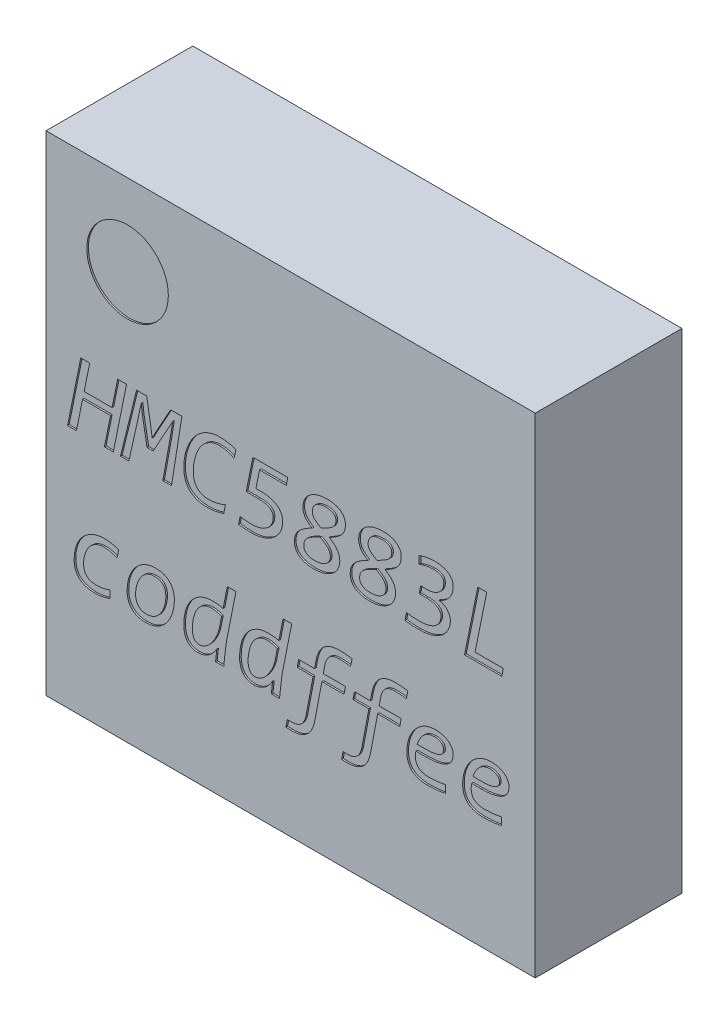
from build123d import *

# Parameters (mm, degrees)
SKETCH_1_W          = 3
SKETCH_1_H          = 3
EXTRUDE_1_DEPTH     = 0.9
SKETCH_3_W          = 0.325
SKETCH_3_H          = 0.25
SKETCH_3_W_2        = 0.25
SKETCH_3_H_2        = 0.325
EXTRUDE_2_DEPTH     = 0.01
SKETCH_4_R          = 0.25
CUT_EXTRUDE_1_DEPTH = 0.01


with BuildPart() as part:
    # 草图1 → 凸台-拉伸1 (new body)
    with BuildSketch(Plane.XY.offset(0.01)):
        Rectangle(SKETCH_1_W, SKETCH_1_H)
    extrude(amount=EXTRUDE_1_DEPTH)

    # 草图3 → 凸台-拉伸2 (add)
    with BuildSketch(Plane.XY):
        with Locations((1.3, 0.25)):
            Rectangle(SKETCH_3_W, SKETCH_3_H)
        with Locations((1.3, 0.75)):
            Rectangle(SKETCH_3_W, SKETCH_3_H)
        with Locations((1.3, -0.25)):
            Rectangle(SKETCH_3_W, SKETCH_3_H)
        with Locations((1.3, -0.75)):
            Rectangle(SKETCH_3_W, SKETCH_3_H)
        with Locations((0.25, -1.3)):
            Rectangle(SKETCH_3_W_2, SKETCH_3_H_2)
        with Locations((0.75, -1.3)):
            Rectangle(SKETCH_3_W_2, SKETCH_3_H_2)
        with Locations((-0.25, -1.3)):
            Rectangle(SKETCH_3_W_2, SKETCH_3_H_2)
        with Locations((-0.75, -1.3)):
            Rectangle(SKETCH_3_W_2, SKETCH_3_H_2)
        with Locations((-1.3, -0.25)):
            Rectangle(SKETCH_3_W, SKETCH_3_H)
        with Locations((-1.3, -0.75)):
            Rectangle(SKETCH_3_W, SKETCH_3_H)
        with Locations((-1.3, 0.25)):
            Rectangle(SKETCH_3_W, SKETCH_3_H)
        with Locations((-1.3, 0.75)):
            Rectangle(SKETCH_3_W, SKETCH_3_H)
        with Locations((-0.25, 1.3)):
            Rectangle(SKETCH_3_W_2, SKETCH_3_H_2)
        with Locations((-0.75, 1.3)):
            Rectangle(SKETCH_3_W_2, SKETCH_3_H_2)
        with Locations((0.25, 1.3)):
            Rectangle(SKETCH_3_W_2, SKETCH_3_H_2)
        with Locations((0.75, 1.3)):
            Rectangle(SKETCH_3_W_2, SKETCH_3_H_2)
    extrude(amount=EXTRUDE_2_DEPTH)

    # 草图4 → 切除-拉伸1 (cut)
    # profile 1 of 17: a face of its own
    with BuildSketch(Plane.XY.offset(0.91)):
        with Locations((-1, 1)):
            Circle(SKETCH_4_R)
    # profile 2 of 17: a face of its own
    with BuildSketch(Plane.XY.offset(0.91)):
        Polygon((-1.087681159, 0), (-1.142028986, 0), (-1.104438406, 0.185507246), (-1.275815217, 0.185507246), (-1.313677536, 0), (-1.368115942, 0), (-1.286956522, 0.4), (-1.232246377, 0.4), (-1.266394928, 0.231884058), (-1.095018116, 0.231884058), (-1.060869565, 0.4), (-1.00615942, 0.4), align=None)
    # profile 3 of 17: a face of its own
    with BuildSketch(Plane.XY.offset(0.91)):
        Polygon((-0.730434783, 0), (-0.783695652, 0), (-0.739583333, 0.243478261), (-0.723188406, 0.344655797), (-0.75298913, 0.291213768), (-0.842844203, 0.127536232), (-0.880525362, 0.127536232), (-0.909148551, 0.285054348), (-0.915851449, 0.344655797), (-0.937047101, 0.245652174), (-0.992119565, 0), (-1.043478261, 0), (-0.944927536, 0.4), (-0.882880435, 0.4), (-0.856702899, 0.245652174), (-0.849275362, 0.193568841), (-0.821557971, 0.245652174), (-0.735688406, 0.4), (-0.666666667, 0.4), align=None)
    # profile 4 of 17: a face of its own
    with BuildSketch(Plane.XY.offset(0.91)):
        with BuildLine():
            add(Edge.make_bspline(
                [(-0.410054348, 0.011594203), (-0.418506185, 0.008971349), (-0.435055239, 0.00383569), (-0.460158421, -0.001789573), (-0.485562014, -0.005214655), (-0.502676193, -0.005600252), (-0.511413043, -0.005797101)],
                knots=[0, 0, 0, 0, 1.027801072, 2.012477991, 2.985362699, 4, 4, 4, 4], degree=3))
            add(Edge.make_bspline(
                [(-0.511413043, -0.005797101), (-0.517003255, -0.005699923), (-0.527876568, -0.005510904), (-0.543681436, -0.003842915), (-0.558523253, -0.001203116), (-0.572322669, 0.002742921), (-0.585232624, 0.007597117), (-0.597088128, 0.013680346), (-0.60802469, 0.020803634), (-0.61791123, 0.02906536), (-0.626774079, 0.038406628), (-0.63434679, 0.04898596), (-0.640768571, 0.060605347), (-0.646062311, 0.073328716), (-0.650127637, 0.087181877), (-0.652930018, 0.102145032), (-0.654843232, 0.118187563), (-0.654994407, 0.129251238), (-0.655072464, 0.134963768)],
                knots=[0, 0, 0, 0, 1.166309873, 2.268546017, 3.312870259, 4.308219106, 5.259596405, 6.18673121, 7.083277722, 7.977984526, 8.86949054, 9.763131687, 10.685436235, 11.634473633, 12.633326539, 13.692374124, 14.808498833, 16, 16, 16, 16], degree=3))
            add(Edge.make_bspline(
                [(-0.655072464, 0.134963768), (-0.655000036, 0.139917275), (-0.654853246, 0.149956522), (-0.65373067, 0.165100556), (-0.651899846, 0.180511188), (-0.64937738, 0.196077422), (-0.646162055, 0.211723162), (-0.642044613, 0.227214106), (-0.63726262, 0.242556418), (-0.631652636, 0.257680613), (-0.625204653, 0.272506895), (-0.618091858, 0.287033192), (-0.610049751, 0.301072687), (-0.601430705, 0.314756524), (-0.591937009, 0.327799852), (-0.581615488, 0.340031009), (-0.570469361, 0.351435027), (-0.558569194, 0.362045295), (-0.545749195, 0.371621151), (-0.532237561, 0.380347847), (-0.517732057, 0.387705685), (-0.502503248, 0.394225291), (-0.486350246, 0.399397499), (-0.469306293, 0.403085502), (-0.451393777, 0.405429224), (-0.439137885, 0.40567276), (-0.432880435, 0.405797101)],
                knots=[0, 0, 0, 0, 0.914461362, 1.853334108, 2.801969121, 3.778876732, 4.763893439, 5.749556623, 6.736857749, 7.729854755, 8.726038458, 9.72072381, 10.714283917, 11.711714525, 12.705149526, 13.69010314, 14.663760967, 15.647009524, 16.630321284, 17.615353764, 18.612597436, 19.629281783, 20.671144063, 21.738303631, 22.845253083, 24, 24, 24, 24], degree=3))
            add(Edge.make_bspline(
                [(-0.432880435, 0.405797101), (-0.428349892, 0.405749265), (-0.419402134, 0.405654789), (-0.406172528, 0.404773787), (-0.393313131, 0.403589824), (-0.380894911, 0.40165342), (-0.368920542, 0.399220311), (-0.357480095, 0.396266086), (-0.346565821, 0.39274679), (-0.339655209, 0.389843838), (-0.336231884, 0.388405797)],
                knots=[0, 0, 0, 0, 1.099418001, 2.171335069, 3.216954463, 4.232614642, 5.219936943, 6.181496291, 7.099164038, 8, 8, 8, 8], degree=3))
            Line((-0.336231884, 0.388405797), (-0.34692029, 0.336231884))
            add(Edge.make_bspline(
                [(-0.34692029, 0.336231884), (-0.350123078, 0.338067363), (-0.356527796, 0.341737828), (-0.366611687, 0.346259163), (-0.376883154, 0.350338468), (-0.387559337, 0.353570207), (-0.398706679, 0.356252861), (-0.410542425, 0.358151353), (-0.423138142, 0.359219096), (-0.431791437, 0.35935206), (-0.436231884, 0.35942029)],
                knots=[0, 0, 0, 0, 0.94749287, 1.894731857, 2.83505811, 3.784294591, 4.756686583, 5.777821475, 6.859686923, 8, 8, 8, 8], degree=3))
            add(Edge.make_bspline(
                [(-0.436231884, 0.35942029), (-0.440886637, 0.359291886), (-0.450020873, 0.359039912), (-0.463398113, 0.357256246), (-0.476065127, 0.354029428), (-0.488056575, 0.349696507), (-0.499285642, 0.344213144), (-0.509859035, 0.337899376), (-0.519876661, 0.330879276), (-0.529095185, 0.322835322), (-0.53771456, 0.31413636), (-0.54569034, 0.304746716), (-0.553177265, 0.29477958), (-0.562148998, 0.280506798), (-0.571956165, 0.261682142), (-0.581334255, 0.238032965), (-0.588455699, 0.213718458), (-0.593493795, 0.189268379), (-0.59644697, 0.16519938), (-0.596887117, 0.149373284), (-0.597101449, 0.141666667)],
                knots=[0, 0, 0, 0, 0.835990689, 1.640502986, 2.417816419, 3.179499065, 3.926523602, 4.658455982, 5.389725115, 6.120270021, 6.852684384, 7.587343825, 8.331370469, 9.089589716, 10.612848828, 12.136455409, 13.651623142, 15.157592175, 16.615871508, 18, 18, 18, 18], degree=3))
            add(Edge.make_bspline(
                [(-0.597101449, 0.141666667), (-0.597032743, 0.137588523), (-0.596899144, 0.129658506), (-0.595847127, 0.118173082), (-0.593926412, 0.10748592), (-0.591312244, 0.097570982), (-0.588002389, 0.088417351), (-0.583896073, 0.080043942), (-0.578981183, 0.072543664), (-0.573443224, 0.065712404), (-0.567009635, 0.059824519), (-0.559913129, 0.054584697), (-0.551995506, 0.050273525), (-0.543366788, 0.046712621), (-0.534023282, 0.0439105), (-0.523920782, 0.041947477), (-0.513072673, 0.040747934), (-0.505589014, 0.040637031), (-0.501721014, 0.04057971)],
                knots=[0, 0, 0, 0, 1.227777673, 2.387433787, 3.468037588, 4.493389877, 5.471217022, 6.394086917, 7.294245877, 8.166049166, 9.034433233, 9.912658732, 10.815933707, 11.741084229, 12.718911374, 13.747602992, 14.835827506, 16, 16, 16, 16], degree=3))
            add(Edge.make_bspline(
                [(-0.501721014, 0.04057971), (-0.497430639, 0.040641106), (-0.488833653, 0.040764131), (-0.475895036, 0.042030916), (-0.46286326, 0.043915787), (-0.44976874, 0.046538058), (-0.436823434, 0.049853501), (-0.424166977, 0.053881015), (-0.41187765, 0.058446151), (-0.403937311, 0.062003943), (-0.4, 0.063768116)],
                knots=[0, 0, 0, 0, 0.979165449, 1.962035789, 2.965097649, 3.984346361, 5.009150236, 6.014104936, 7.015270379, 8, 8, 8, 8], degree=3))
            Line((-0.4, 0.063768116), (-0.410054348, 0.011594203))
        make_face()
    # profile 5 of 17: a face of its own
    with BuildSketch(Plane.XY.offset(0.91)):
        with BuildLine():
            add(Edge.make_bspline(
                [(-0.049003623, 0.148550725), (-0.049172472, 0.143254763), (-0.04950666, 0.132772919), (-0.052342911, 0.117324186), (-0.056865108, 0.102386342), (-0.063243517, 0.088053627), (-0.071272973, 0.074485054), (-0.080584703, 0.061655593), (-0.091412346, 0.049803486), (-0.103517501, 0.038843367), (-0.116983422, 0.029010501), (-0.131539947, 0.020115517), (-0.147413449, 0.012589594), (-0.164285828, 0.005924739), (-0.18223837, 0.000704714), (-0.201017801, -0.003091315), (-0.220623454, -0.005422894), (-0.233960873, -0.005670739), (-0.24076087, -0.005797101)],
                knots=[0, 0, 0, 0, 0.928717278, 1.838130619, 2.746540185, 3.662152379, 4.583571444, 5.508730259, 6.438942558, 7.39553379, 8.369400545, 9.360751507, 10.384464482, 11.448066924, 12.541215522, 13.66031397, 14.807126362, 16, 16, 16, 16], degree=3))
            add(Edge.make_bspline(
                [(-0.24076087, -0.005797101), (-0.244173053, -0.005786386), (-0.251089954, -0.005764666), (-0.261537848, -0.005368913), (-0.272013308, -0.004815693), (-0.282344191, -0.00421052), (-0.29234124, -0.003401067), (-0.301855621, -0.002417878), (-0.310656256, -0.001299792), (-0.316217216, -0.000293537), (-0.31884058, 0.000181159)],
                knots=[0, 0, 0, 0, 1.044502813, 2.117331066, 3.200186155, 4.255875667, 5.285218462, 6.27024057, 7.183992095, 8, 8, 8, 8], degree=3))
            Line((-0.31884058, 0.000181159), (-0.309692029, 0.046376812))
            add(Edge.make_bspline(
                [(-0.309692029, 0.046376812), (-0.306947346, 0.045876639), (-0.301261952, 0.04484057), (-0.2924419, 0.043582627), (-0.283220711, 0.042636604), (-0.273769498, 0.041814229), (-0.264258523, 0.041163535), (-0.254742619, 0.04082425), (-0.245441406, 0.040658079), (-0.239311648, 0.040605399), (-0.236322464, 0.04057971)],
                knots=[0, 0, 0, 0, 0.908406311, 1.881692453, 2.900113492, 3.926429204, 4.970856668, 6.003931323, 7.026614548, 8, 8, 8, 8], degree=3))
            add(Edge.make_bspline(
                [(-0.236322464, 0.04057971), (-0.231669112, 0.040658383), (-0.22252002, 0.040813063), (-0.209126204, 0.042273518), (-0.196355519, 0.044747601), (-0.184221824, 0.048057954), (-0.1727742, 0.052330906), (-0.162127768, 0.057396386), (-0.152216635, 0.06309737), (-0.143267385, 0.069671232), (-0.135067645, 0.076782478), (-0.127891754, 0.08461082), (-0.121674201, 0.09302404), (-0.116408846, 0.101963594), (-0.112234449, 0.111451179), (-0.109093151, 0.12129963), (-0.107382721, 0.131583379), (-0.107111692, 0.138520845), (-0.106974638, 0.142028986)],
                knots=[0, 0, 0, 0, 1.220166707, 2.399005841, 3.528093536, 4.628946758, 5.693896036, 6.728226176, 7.71835301, 8.687741905, 9.636071676, 10.560831783, 11.466786123, 12.375401534, 13.275940511, 14.180128012, 15.079726406, 16, 16, 16, 16], degree=3))
            add(Edge.make_bspline(
                [(-0.106974638, 0.142028986), (-0.107047431, 0.144236919), (-0.107188811, 0.148525172), (-0.108194899, 0.154765957), (-0.109896261, 0.160596296), (-0.112375353, 0.165973072), (-0.115494452, 0.17095062), (-0.119317167, 0.175479475), (-0.123832785, 0.179602411), (-0.129019469, 0.183330138), (-0.134956866, 0.186589898), (-0.141649703, 0.189390422), (-0.149041668, 0.191801105), (-0.157202401, 0.193847727), (-0.166127525, 0.195191267), (-0.175794727, 0.196284129), (-0.186189477, 0.197055045), (-0.193386223, 0.19708565), (-0.197101449, 0.197101449)],
                knots=[0, 0, 0, 0, 0.888619011, 1.725878067, 2.537330492, 3.325977742, 4.101591725, 4.895280693, 5.703906225, 6.557330919, 7.460461648, 8.424439527, 9.47375797, 10.588079712, 11.807001866, 13.103622345, 14.504782878, 16, 16, 16, 16], degree=3))
            Line((-0.197101449, 0.197101449), (-0.272463768, 0.197101449))
            Line((-0.272463768, 0.197101449), (-0.231431159, 0.4))
            Line((-0.231431159, 0.4), (-0.017391304, 0.4))
            Line((-0.017391304, 0.4), (-0.026811594, 0.353623188))
            Line((-0.026811594, 0.353623188), (-0.19048913, 0.353623188))
            Line((-0.19048913, 0.353623188), (-0.212771739, 0.243478261))
            Line((-0.212771739, 0.243478261), (-0.18125, 0.243478261))
            add(Edge.make_bspline(
                [(-0.18125, 0.243478261), (-0.176810789, 0.243391372), (-0.168074331, 0.243220372), (-0.155116676, 0.242381918), (-0.142587448, 0.240584124), (-0.130410873, 0.238377126), (-0.118781528, 0.235461756), (-0.107857971, 0.231623453), (-0.097676668, 0.22708625), (-0.088202415, 0.22188888), (-0.079642689, 0.215737621), (-0.071839014, 0.208913295), (-0.065244356, 0.200954892), (-0.059338443, 0.192381902), (-0.054682269, 0.182742156), (-0.051346055, 0.172163181), (-0.049316844, 0.16064516), (-0.049110188, 0.152665537), (-0.049003623, 0.148550725)],
                knots=[0, 0, 0, 0, 1.160525095, 2.283937116, 3.391098912, 4.466848082, 5.51767417, 6.521020575, 7.488982201, 8.428737089, 9.339719699, 10.239558793, 11.129795246, 12.033777585, 12.954991884, 13.915882227, 14.925293447, 16, 16, 16, 16], degree=3))
        make_face()
    # profile 6 of 17: a face of its own
    with BuildSketch(Plane.XY.offset(0.91)):
        with BuildLine():
            add(Edge.make_bspline(
                [(0.236684783, 0.208695652), (0.241665153, 0.205799123), (0.251294065, 0.200199052), (0.26430776, 0.190566564), (0.275475068, 0.180284022), (0.284838946, 0.169363058), (0.292374238, 0.157639852), (0.29770344, 0.144840784), (0.300816062, 0.130975449), (0.301234832, 0.121392653), (0.301449275, 0.116485507)],
                knots=[0, 0, 0, 0, 1.16302713, 2.248565179, 3.262685119, 4.223144618, 5.146911155, 6.065428976, 7.009347288, 8, 8, 8, 8], degree=3))
            add(Edge.make_bspline(
                [(0.301449275, 0.116485507), (0.301323622, 0.112583853), (0.301071808, 0.104764796), (0.299142142, 0.093138947), (0.295798073, 0.081759461), (0.291401052, 0.070614425), (0.285707078, 0.059861239), (0.278525958, 0.049807667), (0.270301018, 0.040223065), (0.260704161, 0.031452951), (0.249956416, 0.023308456), (0.237881642, 0.016091844), (0.224526655, 0.009786046), (0.210088768, 0.004099362), (0.194275191, -0.000307196), (0.177255644, -0.003559567), (0.158949932, -0.005455751), (0.146351084, -0.005680975), (0.139855072, -0.005797101)],
                knots=[0, 0, 0, 0, 0.827593171, 1.658526668, 2.491827361, 3.339991075, 4.196891407, 5.065965175, 5.956057141, 6.871782887, 7.81859707, 8.812852831, 9.850075368, 10.949301728, 12.101140207, 13.327354751, 14.621974509, 16, 16, 16, 16], degree=3))
            add(Edge.make_bspline(
                [(0.139855072, -0.005797101), (0.135052617, -0.005697283), (0.125764957, -0.00550424), (0.112311685, -0.004390993), (0.099855258, -0.002257585), (0.088313536, 0.000470151), (0.077783604, 0.004117539), (0.068221237, 0.008392695), (0.059547021, 0.013187395), (0.051777317, 0.01859781), (0.045088688, 0.024766268), (0.039064143, 0.031255983), (0.034202108, 0.038529449), (0.030074384, 0.04620377), (0.02699358, 0.054442187), (0.024875129, 0.063051646), (0.02342504, 0.07202293), (0.023268312, 0.078134226), (0.023188406, 0.08125)],
                knots=[0, 0, 0, 0, 1.403882476, 2.715024335, 3.940981093, 5.094673495, 6.177537217, 7.192767505, 8.152797459, 9.070988294, 9.951951262, 10.807984712, 11.652476845, 12.501246545, 13.350291477, 14.215014925, 15.089945652, 16, 16, 16, 16], degree=3))
            add(Edge.make_bspline(
                [(0.023188406, 0.08125), (0.023436226, 0.086854547), (0.023925431, 0.097918142), (0.027096392, 0.111489329), (0.031060344, 0.121885516), (0.035008277, 0.129655473), (0.039904221, 0.137296379), (0.045689335, 0.144898387), (0.052437162, 0.152475341), (0.060329526, 0.159930532), (0.069266565, 0.167383309), (0.079307876, 0.174848739), (0.09060785, 0.182365867), (0.103236649, 0.190072206), (0.117288777, 0.197952909), (0.12724666, 0.203053035), (0.132427536, 0.205706522)],
                knots=[0, 0, 0, 0, 1.340524537, 2.646247884, 3.311810545, 4.000086208, 4.72770418, 5.480605303, 6.284057581, 7.152852228, 8.076123924, 9.0674556, 10.145593656, 11.322827045, 12.607123646, 14, 14, 14, 14], degree=3))
            add(Edge.make_bspline(
                [(0.132427536, 0.205706522), (0.127867905, 0.208359837), (0.11911398, 0.213453874), (0.107400639, 0.222348388), (0.097478385, 0.231727953), (0.089299775, 0.241718949), (0.083071091, 0.252465783), (0.078554741, 0.26393112), (0.075876114, 0.276236069), (0.075536109, 0.284709015), (0.075362319, 0.289039855)],
                knots=[0, 0, 0, 0, 1.187718502, 2.280272025, 3.305159112, 4.258167286, 5.178768493, 6.092127416, 7.024814717, 8, 8, 8, 8], degree=3))
            add(Edge.make_bspline(
                [(0.075362319, 0.289039855), (0.075447884, 0.292702325), (0.075619372, 0.300042579), (0.077613059, 0.310935429), (0.080311581, 0.321790494), (0.084469033, 0.332346279), (0.089575806, 0.342653337), (0.096039914, 0.352322617), (0.103655209, 0.361381071), (0.112394347, 0.369818866), (0.122294041, 0.377668736), (0.133488232, 0.384592787), (0.145794057, 0.390773122), (0.159256956, 0.396148609), (0.173927173, 0.400463663), (0.189797415, 0.403669079), (0.206874354, 0.405426611), (0.218655568, 0.405671086), (0.224728261, 0.405797101)],
                knots=[0, 0, 0, 0, 0.82835749, 1.660178746, 2.501000179, 3.358121958, 4.223494879, 5.10152514, 5.984863977, 6.898768163, 7.848101824, 8.84032123, 9.873874238, 10.963275164, 12.118554487, 13.332114692, 14.624823572, 16, 16, 16, 16], degree=3))
            add(Edge.make_bspline(
                [(0.224728261, 0.405797101), (0.229259212, 0.405729905), (0.238033047, 0.405599784), (0.25078081, 0.40453237), (0.262607506, 0.402628883), (0.273567749, 0.400095132), (0.283637933, 0.396953341), (0.292839876, 0.393161172), (0.301118047, 0.388715301), (0.308519065, 0.383699065), (0.315087633, 0.378179647), (0.32075978, 0.372072219), (0.325507124, 0.365385837), (0.329401803, 0.358198243), (0.332501563, 0.350579952), (0.334676149, 0.342551004), (0.335958511, 0.334159715), (0.336139779, 0.32844647), (0.336231884, 0.325543478)],
                knots=[0, 0, 0, 0, 1.404218958, 2.719161522, 3.960728693, 5.113869416, 6.203037102, 7.226673131, 8.193871375, 9.110108583, 9.993201038, 10.847460707, 11.686202137, 12.527914048, 13.375948864, 14.229541923, 15.100401552, 16, 16, 16, 16], degree=3))
            add(Edge.make_bspline(
                [(0.336231884, 0.325543478), (0.336004707, 0.320151793), (0.335558283, 0.309556632), (0.332614815, 0.296601648), (0.328988271, 0.286741732), (0.325416167, 0.27942161), (0.320936175, 0.272234989), (0.315777336, 0.264970312), (0.3095221, 0.257942203), (0.302460034, 0.25080897), (0.294264906, 0.243873412), (0.285030753, 0.236978017), (0.274747445, 0.229960047), (0.26321405, 0.222917837), (0.250411794, 0.215767599), (0.241379144, 0.211114116), (0.236684783, 0.208695652)],
                knots=[0, 0, 0, 0, 1.389482473, 2.730461661, 3.402937092, 4.09583286, 4.826204519, 5.58462667, 6.390250091, 7.249041127, 8.171169234, 9.155238164, 10.219811244, 11.380141216, 12.638432287, 14, 14, 14, 14], degree=3))
        make_face()
        with BuildLine():
            add(Edge.make_bspline(
                [(0.188043478, 0.232608696), (0.192431629, 0.234823535), (0.200823494, 0.239059176), (0.212664241, 0.245421111), (0.223300376, 0.251276325), (0.232729197, 0.256856437), (0.241117461, 0.262165602), (0.248444629, 0.267460399), (0.254974802, 0.27249549), (0.260485508, 0.277613161), (0.265288266, 0.282549713), (0.269072098, 0.287599609), (0.272255008, 0.292480911), (0.27525721, 0.299117305), (0.277836805, 0.307936325), (0.278116829, 0.315256391), (0.27826087, 0.319021739)],
                knots=[0, 0, 0, 0, 1.564139869, 2.991248565, 4.277247889, 5.427432494, 6.477549114, 7.434764593, 8.303607888, 9.099238584, 9.826488812, 10.49140495, 11.104528983, 11.676280622, 12.804708543, 14, 14, 14, 14], degree=3))
            add(Edge.make_bspline(
                [(0.27826087, 0.319021739), (0.278078273, 0.322036572), (0.277724026, 0.327885498), (0.274702021, 0.336109413), (0.269707897, 0.343245899), (0.262726193, 0.34915883), (0.2539482, 0.353906051), (0.243338918, 0.3571717), (0.230991139, 0.359138941), (0.222170061, 0.359322652), (0.217481884, 0.35942029)],
                knots=[0, 0, 0, 0, 0.879363224, 1.706008061, 2.523980814, 3.400147634, 4.356238525, 5.422726243, 6.630245249, 8, 8, 8, 8], degree=3))
            add(Edge.make_bspline(
                [(0.217481884, 0.35942029), (0.214430054, 0.359372797), (0.208435967, 0.359279518), (0.199670555, 0.35841003), (0.191265743, 0.35721288), (0.18334717, 0.355283742), (0.17589747, 0.352937694), (0.168911413, 0.350151276), (0.162520057, 0.346678031), (0.156571981, 0.342820454), (0.151310222, 0.3383471), (0.146653164, 0.333433445), (0.142616782, 0.328035805), (0.139260868, 0.322137811), (0.136619782, 0.315745566), (0.134722115, 0.308873832), (0.13350928, 0.301552616), (0.133392693, 0.296502441), (0.133333333, 0.293931159)],
                knots=[0, 0, 0, 0, 1.217458127, 2.391204513, 3.512448451, 4.602508703, 5.638979385, 6.627929615, 7.598207543, 8.537235572, 9.452066456, 10.347003848, 11.233793425, 12.134954435, 13.047879088, 13.986288522, 14.97472484, 16, 16, 16, 16], degree=3))
            add(Edge.make_bspline(
                [(0.133333333, 0.293931159), (0.133468758, 0.29108011), (0.133738269, 0.285406179), (0.136041658, 0.277096931), (0.14024974, 0.269329081), (0.145967464, 0.261760592), (0.153697002, 0.254491164), (0.163342161, 0.247280606), (0.174923588, 0.239835969), (0.183482926, 0.235120939), (0.188043478, 0.232608696)],
                knots=[0, 0, 0, 0, 0.789258287, 1.570718488, 2.3640456, 3.22408936, 4.188518442, 5.292878118, 6.557602109, 8, 8, 8, 8], degree=3))
        make_face(mode=Mode.SUBTRACT)
        with BuildLine():
            add(Edge.make_bspline(
                [(0.181521739, 0.181793478), (0.176681396, 0.179609613), (0.167384731, 0.175415146), (0.154224728, 0.16908955), (0.14236344, 0.163146333), (0.131938466, 0.157321986), (0.122639278, 0.151740755), (0.114393305, 0.146280356), (0.107218033, 0.140734566), (0.101009373, 0.135268891), (0.095621786, 0.129867947), (0.091428141, 0.124149832), (0.087758801, 0.118592594), (0.084384218, 0.110793559), (0.08176989, 0.100255759), (0.08136814, 0.091563141), (0.08115942, 0.087047101)],
                knots=[0, 0, 0, 0, 1.515722843, 2.911191449, 4.167735237, 5.302023236, 6.318945302, 7.263144588, 8.123365756, 8.9049547, 9.624182123, 10.294718268, 10.925997816, 11.520181557, 12.711670249, 14, 14, 14, 14], degree=3))
            add(Edge.make_bspline(
                [(0.08115942, 0.087047101), (0.081208636, 0.085141778), (0.081304423, 0.081433505), (0.082128609, 0.076084319), (0.083480093, 0.071076629), (0.08549059, 0.066507056), (0.087938718, 0.06222037), (0.0910744, 0.058451567), (0.09463475, 0.054920705), (0.100340878, 0.050775555), (0.108866428, 0.046531596), (0.120738011, 0.043103721), (0.134401571, 0.040926163), (0.144133326, 0.040699483), (0.149275362, 0.04057971)],
                knots=[0, 0, 0, 0, 0.733793023, 1.428158542, 2.080199921, 2.726402628, 3.34696055, 3.975644849, 4.609154941, 5.274654599, 6.684713661, 8.252630501, 10.019975983, 12, 12, 12, 12], degree=3))
            add(Edge.make_bspline(
                [(0.149275362, 0.04057971), (0.155208814, 0.040815859), (0.166989282, 0.041284716), (0.181416512, 0.044168587), (0.192463902, 0.047482462), (0.200194749, 0.05070429), (0.207574072, 0.054229792), (0.214419249, 0.058358933), (0.220678563, 0.063090204), (0.226353257, 0.068276701), (0.231378233, 0.073992274), (0.235606219, 0.080286015), (0.239253357, 0.08695021), (0.24162912, 0.094232568), (0.243280132, 0.101857799), (0.243411603, 0.107116414), (0.243478261, 0.109782609)],
                knots=[0, 0, 0, 0, 1.916913983, 3.805902963, 4.735034662, 5.641126453, 6.509653565, 7.376589313, 8.219745981, 9.041625869, 9.857749939, 10.672472537, 11.488771622, 12.30349422, 13.139846554, 14, 14, 14, 14], degree=3))
            add(Edge.make_bspline(
                [(0.243478261, 0.109782609), (0.24331995, 0.112939066), (0.243000156, 0.119315217), (0.240385327, 0.128768179), (0.236265555, 0.138172205), (0.229692176, 0.147139023), (0.221296873, 0.156128131), (0.210327152, 0.16479632), (0.197018734, 0.173678092), (0.186924302, 0.178964292), (0.181521739, 0.181793478)],
                knots=[0, 0, 0, 0, 0.754885403, 1.524894363, 2.334045626, 3.200768717, 4.172805262, 5.272847167, 6.540421679, 8, 8, 8, 8], degree=3))
        make_face(mode=Mode.SUBTRACT)
    # profile 7 of 17: a face of its own
    with BuildSketch(Plane.XY.offset(0.91)):
        with BuildLine():
            add(Edge.make_bspline(
                [(0.578713768, 0.208695652), (0.583694138, 0.205799123), (0.593323051, 0.200199052), (0.606336745, 0.190566564), (0.617504053, 0.180284022), (0.626867932, 0.169363058), (0.634403223, 0.157639852), (0.639732425, 0.144840784), (0.642845047, 0.130975449), (0.643263818, 0.121392653), (0.643478261, 0.116485507)],
                knots=[0, 0, 0, 0, 1.16302713, 2.248565179, 3.262685119, 4.223144618, 5.146911155, 6.065428976, 7.009347288, 8, 8, 8, 8], degree=3))
            add(Edge.make_bspline(
                [(0.643478261, 0.116485507), (0.643352607, 0.112583853), (0.643100793, 0.104764796), (0.641171128, 0.093138947), (0.637827058, 0.081759461), (0.633430038, 0.070614425), (0.627736064, 0.059861239), (0.620554944, 0.049807667), (0.612330004, 0.040223065), (0.602733147, 0.031452951), (0.591985401, 0.023308456), (0.579910628, 0.016091844), (0.566555641, 0.009786046), (0.552117753, 0.004099362), (0.536304177, -0.000307196), (0.51928463, -0.003559567), (0.500978917, -0.005455751), (0.488380069, -0.005680975), (0.481884058, -0.005797101)],
                knots=[0, 0, 0, 0, 0.827593171, 1.658526668, 2.491827361, 3.339991075, 4.196891407, 5.065965175, 5.956057141, 6.871782887, 7.81859707, 8.812852831, 9.850075368, 10.949301728, 12.101140207, 13.327354751, 14.621974509, 16, 16, 16, 16], degree=3))
            add(Edge.make_bspline(
                [(0.481884058, -0.005797101), (0.477081603, -0.005697283), (0.467793943, -0.00550424), (0.45434067, -0.004390993), (0.441884244, -0.002257585), (0.430342522, 0.000470151), (0.419812589, 0.004117539), (0.410250223, 0.008392695), (0.401576006, 0.013187395), (0.393806303, 0.01859781), (0.387117674, 0.024766268), (0.381093129, 0.031255983), (0.376231094, 0.038529449), (0.372103369, 0.04620377), (0.369022565, 0.054442187), (0.366904115, 0.063051646), (0.365454025, 0.07202293), (0.365297297, 0.078134226), (0.365217391, 0.08125)],
                knots=[0, 0, 0, 0, 1.403882476, 2.715024335, 3.940981093, 5.094673495, 6.177537217, 7.192767505, 8.152797459, 9.070988294, 9.951951262, 10.807984712, 11.652476845, 12.501246545, 13.350291477, 14.215014925, 15.089945652, 16, 16, 16, 16], degree=3))
            add(Edge.make_bspline(
                [(0.365217391, 0.08125), (0.365465211, 0.086854547), (0.365954417, 0.097918142), (0.369125378, 0.111489329), (0.37308933, 0.121885516), (0.377037262, 0.129655473), (0.381933206, 0.137296379), (0.38771832, 0.144898387), (0.394466148, 0.152475341), (0.402358512, 0.159930532), (0.41129555, 0.167383309), (0.421336861, 0.174848739), (0.432636836, 0.182365867), (0.445265635, 0.190072206), (0.459317762, 0.197952909), (0.469275646, 0.203053035), (0.474456522, 0.205706522)],
                knots=[0, 0, 0, 0, 1.340524537, 2.646247884, 3.311810545, 4.000086208, 4.72770418, 5.480605303, 6.284057581, 7.152852228, 8.076123924, 9.0674556, 10.145593656, 11.322827045, 12.607123646, 14, 14, 14, 14], degree=3))
            add(Edge.make_bspline(
                [(0.474456522, 0.205706522), (0.469896891, 0.208359837), (0.461142966, 0.213453874), (0.449429625, 0.222348388), (0.43950737, 0.231727953), (0.43132876, 0.241718949), (0.425100076, 0.252465783), (0.420583726, 0.26393112), (0.4179051, 0.276236069), (0.417565094, 0.284709015), (0.417391304, 0.289039855)],
                knots=[0, 0, 0, 0, 1.187718502, 2.280272025, 3.305159112, 4.258167286, 5.178768493, 6.092127416, 7.024814717, 8, 8, 8, 8], degree=3))
            add(Edge.make_bspline(
                [(0.417391304, 0.289039855), (0.417476869, 0.292702325), (0.417648357, 0.300042579), (0.419642045, 0.310935429), (0.422340566, 0.321790494), (0.426498019, 0.332346279), (0.431604791, 0.342653337), (0.438068899, 0.352322617), (0.445684195, 0.361381071), (0.454423332, 0.369818866), (0.464323027, 0.377668736), (0.475517218, 0.384592787), (0.487823042, 0.390773122), (0.501285941, 0.396148609), (0.515956159, 0.400463663), (0.531826401, 0.403669079), (0.54890334, 0.405426611), (0.560684554, 0.405671086), (0.566757246, 0.405797101)],
                knots=[0, 0, 0, 0, 0.82835749, 1.660178746, 2.501000179, 3.358121958, 4.223494879, 5.10152514, 5.984863977, 6.898768163, 7.848101824, 8.84032123, 9.873874238, 10.963275164, 12.118554487, 13.332114692, 14.624823572, 16, 16, 16, 16], degree=3))
            add(Edge.make_bspline(
                [(0.566757246, 0.405797101), (0.571288197, 0.405729905), (0.580062033, 0.405599784), (0.592809796, 0.40453237), (0.604636491, 0.402628883), (0.615596734, 0.400095132), (0.625666919, 0.396953341), (0.634868861, 0.393161172), (0.643147032, 0.388715301), (0.65054805, 0.383699065), (0.657116618, 0.378179647), (0.662788765, 0.372072219), (0.667536109, 0.365385837), (0.671430788, 0.358198243), (0.674530549, 0.350579952), (0.676705135, 0.342551004), (0.677987496, 0.334159715), (0.678168764, 0.32844647), (0.67826087, 0.325543478)],
                knots=[0, 0, 0, 0, 1.404218958, 2.719161522, 3.960728693, 5.113869416, 6.203037102, 7.226673131, 8.193871375, 9.110108583, 9.993201038, 10.847460707, 11.686202137, 12.527914048, 13.375948864, 14.229541923, 15.100401552, 16, 16, 16, 16], degree=3))
            add(Edge.make_bspline(
                [(0.67826087, 0.325543478), (0.678033692, 0.320151793), (0.677587268, 0.309556632), (0.674643801, 0.296601648), (0.671017257, 0.286741732), (0.667445153, 0.27942161), (0.662965161, 0.272234989), (0.657806322, 0.264970312), (0.651551086, 0.257942203), (0.644489019, 0.25080897), (0.636293891, 0.243873412), (0.627059738, 0.236978017), (0.616776431, 0.229960047), (0.605243035, 0.222917837), (0.592440779, 0.215767599), (0.58340813, 0.211114116), (0.578713768, 0.208695652)],
                knots=[0, 0, 0, 0, 1.389482473, 2.730461661, 3.402937092, 4.09583286, 4.826204519, 5.58462667, 6.390250091, 7.249041127, 8.171169234, 9.155238164, 10.219811244, 11.380141216, 12.638432287, 14, 14, 14, 14], degree=3))
        make_face()
        with BuildLine():
            add(Edge.make_bspline(
                [(0.530072464, 0.232608696), (0.534460615, 0.234823535), (0.54285248, 0.239059176), (0.554693227, 0.245421111), (0.565329361, 0.251276325), (0.574758182, 0.256856437), (0.583146447, 0.262165602), (0.590473615, 0.267460399), (0.597003788, 0.27249549), (0.602514494, 0.277613161), (0.607317252, 0.282549713), (0.611101084, 0.287599609), (0.614283993, 0.292480911), (0.617286196, 0.299117305), (0.61986579, 0.307936325), (0.620145814, 0.315256391), (0.620289855, 0.319021739)],
                knots=[0, 0, 0, 0, 1.564139869, 2.991248565, 4.277247889, 5.427432494, 6.477549114, 7.434764593, 8.303607888, 9.099238584, 9.826488812, 10.49140495, 11.104528983, 11.676280622, 12.804708543, 14, 14, 14, 14], degree=3))
            add(Edge.make_bspline(
                [(0.620289855, 0.319021739), (0.620107258, 0.322036572), (0.619753011, 0.327885498), (0.616731007, 0.336109413), (0.611736882, 0.343245899), (0.604755178, 0.34915883), (0.595977185, 0.353906051), (0.585367904, 0.3571717), (0.573020125, 0.359138941), (0.564199046, 0.359322652), (0.55951087, 0.35942029)],
                knots=[0, 0, 0, 0, 0.879363224, 1.706008061, 2.523980814, 3.400147634, 4.356238525, 5.422726243, 6.630245249, 8, 8, 8, 8], degree=3))
            add(Edge.make_bspline(
                [(0.55951087, 0.35942029), (0.55645904, 0.359372797), (0.550464953, 0.359279518), (0.54169954, 0.35841003), (0.533294729, 0.35721288), (0.525376156, 0.355283742), (0.517926456, 0.352937694), (0.510940399, 0.350151276), (0.504549042, 0.346678031), (0.498600967, 0.342820454), (0.493339207, 0.3383471), (0.48868215, 0.333433445), (0.484645768, 0.328035805), (0.481289854, 0.322137811), (0.478648767, 0.315745566), (0.476751101, 0.308873832), (0.475538265, 0.301552616), (0.475421679, 0.296502441), (0.475362319, 0.293931159)],
                knots=[0, 0, 0, 0, 1.217458127, 2.391204513, 3.512448451, 4.602508703, 5.638979385, 6.627929615, 7.598207543, 8.537235572, 9.452066456, 10.347003848, 11.233793425, 12.134954435, 13.047879088, 13.986288522, 14.97472484, 16, 16, 16, 16], degree=3))
            add(Edge.make_bspline(
                [(0.475362319, 0.293931159), (0.475497743, 0.29108011), (0.475767254, 0.285406179), (0.478070644, 0.277096931), (0.482278725, 0.269329081), (0.48799645, 0.261760592), (0.495725987, 0.254491164), (0.505371146, 0.247280606), (0.516952574, 0.239835969), (0.525511912, 0.235120939), (0.530072464, 0.232608696)],
                knots=[0, 0, 0, 0, 0.789258287, 1.570718488, 2.3640456, 3.22408936, 4.188518442, 5.292878118, 6.557602109, 8, 8, 8, 8], degree=3))
        make_face(mode=Mode.SUBTRACT)
        with BuildLine():
            add(Edge.make_bspline(
                [(0.523550725, 0.181793478), (0.518710381, 0.179609613), (0.509413716, 0.175415146), (0.496253713, 0.16908955), (0.484392425, 0.163146333), (0.473967451, 0.157321986), (0.464668264, 0.151740755), (0.456422291, 0.146280356), (0.449247018, 0.140734566), (0.443038359, 0.135268891), (0.437650772, 0.129867947), (0.433457126, 0.124149832), (0.429787786, 0.118592594), (0.426413204, 0.110793559), (0.423798875, 0.100255759), (0.423397125, 0.091563141), (0.423188406, 0.087047101)],
                knots=[0, 0, 0, 0, 1.515722843, 2.911191449, 4.167735237, 5.302023236, 6.318945302, 7.263144588, 8.123365756, 8.9049547, 9.624182123, 10.294718268, 10.925997816, 11.520181557, 12.711670249, 14, 14, 14, 14], degree=3))
            add(Edge.make_bspline(
                [(0.423188406, 0.087047101), (0.423237621, 0.085141778), (0.423333408, 0.081433505), (0.424157595, 0.076084319), (0.425509079, 0.071076629), (0.427519575, 0.066507056), (0.429967703, 0.06222037), (0.433103386, 0.058451567), (0.436663736, 0.054920705), (0.442369863, 0.050775555), (0.450895414, 0.046531596), (0.462766996, 0.043103721), (0.476430557, 0.040926163), (0.486162312, 0.040699483), (0.491304348, 0.04057971)],
                knots=[0, 0, 0, 0, 0.733793023, 1.428158542, 2.080199921, 2.726402628, 3.34696055, 3.975644849, 4.609154941, 5.274654599, 6.684713661, 8.252630501, 10.019975983, 12, 12, 12, 12], degree=3))
            add(Edge.make_bspline(
                [(0.491304348, 0.04057971), (0.4972378, 0.040815859), (0.509018268, 0.041284716), (0.523445497, 0.044168587), (0.534492888, 0.047482462), (0.542223735, 0.05070429), (0.549603058, 0.054229792), (0.556448235, 0.058358933), (0.562707548, 0.063090204), (0.568382242, 0.068276701), (0.573407219, 0.073992274), (0.577635205, 0.080286015), (0.581282343, 0.08695021), (0.583658105, 0.094232568), (0.585309118, 0.101857799), (0.585440589, 0.107116414), (0.585507246, 0.109782609)],
                knots=[0, 0, 0, 0, 1.916913983, 3.805902963, 4.735034662, 5.641126453, 6.509653565, 7.376589313, 8.219745981, 9.041625869, 9.857749939, 10.672472537, 11.488771622, 12.30349422, 13.139846554, 14, 14, 14, 14], degree=3))
            add(Edge.make_bspline(
                [(0.585507246, 0.109782609), (0.585348935, 0.112939066), (0.585029142, 0.119315217), (0.582414313, 0.128768179), (0.57829454, 0.138172205), (0.571721161, 0.147139023), (0.563325859, 0.156128131), (0.552356138, 0.16479632), (0.539047719, 0.173678092), (0.528953287, 0.178964292), (0.523550725, 0.181793478)],
                knots=[0, 0, 0, 0, 0.754885403, 1.524894363, 2.334045626, 3.200768717, 4.172805262, 5.272847167, 6.540421679, 8, 8, 8, 8], degree=3))
        make_face(mode=Mode.SUBTRACT)
    # profile 8 of 17: a face of its own
    with BuildSketch(Plane.XY.offset(0.91)):
        with BuildLine():
            add(Edge.make_bspline(
                [(0.783605072, -0.005797101), (0.775873926, -0.005739561), (0.760885089, -0.005628005), (0.739310306, -0.004439592), (0.719640445, -0.002588977), (0.707271188, -0.000828578), (0.701449275, 0)],
                knots=[0, 0, 0, 0, 1.125244373, 2.181578477, 3.144112525, 4, 4, 4, 4], degree=3))
            Line((0.701449275, 0), (0.710960145, 0.046376812))
            add(Edge.make_bspline(
                [(0.710960145, 0.046376812), (0.717083434, 0.045511554), (0.729544042, 0.043750796), (0.748767108, 0.042003828), (0.769004749, 0.040734845), (0.782878235, 0.04063251), (0.790036232, 0.04057971)],
                knots=[0, 0, 0, 0, 0.934946204, 1.902572078, 2.917836311, 4, 4, 4, 4], degree=3))
            add(Edge.make_bspline(
                [(0.790036232, 0.04057971), (0.794355326, 0.040627332), (0.802699781, 0.040719338), (0.814822097, 0.041553443), (0.826136489, 0.042873682), (0.836685049, 0.044790919), (0.846478043, 0.047140643), (0.855538156, 0.049867262), (0.863933272, 0.0528425), (0.871660406, 0.056185517), (0.878723856, 0.059914442), (0.885177161, 0.06386013), (0.890933263, 0.068176047), (0.897693803, 0.074096203), (0.904829373, 0.081958538), (0.911497942, 0.09197484), (0.916549652, 0.10205584), (0.91949097, 0.11231101), (0.921421503, 0.122148232), (0.921636478, 0.128614991), (0.92173913, 0.131702899)],
                knots=[0, 0, 0, 0, 1.299772521, 2.511149951, 3.655214155, 4.726477618, 5.735947448, 6.684691384, 7.572880921, 8.415310173, 9.216077775, 9.975127322, 10.689392892, 11.378413035, 12.677994941, 13.870132028, 14.9918547, 16.055498095, 17.071491223, 18, 18, 18, 18], degree=3))
            add(Edge.make_bspline(
                [(0.92173913, 0.131702899), (0.921679099, 0.133911966), (0.92156222, 0.138212923), (0.920381327, 0.144419218), (0.918327701, 0.150125832), (0.915624524, 0.155425737), (0.912101566, 0.160240169), (0.908030124, 0.164749687), (0.90315947, 0.168678427), (0.897806239, 0.172356248), (0.891779732, 0.175523542), (0.885115218, 0.178205221), (0.877875163, 0.180609245), (0.867119535, 0.182961008), (0.852466619, 0.185114663), (0.84037823, 0.18537246), (0.834057971, 0.185507246)],
                knots=[0, 0, 0, 0, 0.804369065, 1.566071281, 2.289882201, 3.008321537, 3.725833582, 4.457793348, 5.215671894, 5.999924738, 6.821859818, 7.690201543, 8.615699399, 9.597862057, 11.698398745, 14, 14, 14, 14], degree=3))
            Line((0.834057971, 0.185507246), (0.788405797, 0.185507246))
            Line((0.788405797, 0.185507246), (0.797282609, 0.231884058))
            Line((0.797282609, 0.231884058), (0.839039855, 0.231884058))
            add(Edge.make_bspline(
                [(0.839039855, 0.231884058), (0.842273986, 0.231950504), (0.848700226, 0.232082533), (0.858228946, 0.233239812), (0.867595302, 0.234922368), (0.87674295, 0.237379137), (0.885546238, 0.240490559), (0.893860128, 0.244352949), (0.901660745, 0.248744615), (0.908854103, 0.253877878), (0.915498572, 0.259548319), (0.921385462, 0.265929222), (0.926612558, 0.272858623), (0.931031049, 0.280398151), (0.934757856, 0.288483681), (0.937214947, 0.297229406), (0.938823011, 0.306462789), (0.939026424, 0.31279486), (0.939130435, 0.316032609)],
                knots=[0, 0, 0, 0, 1.062351751, 2.110900083, 3.150065349, 4.187334327, 5.219799677, 6.214188602, 7.196225628, 8.156981984, 9.113682657, 10.061441281, 11.003992401, 11.960281412, 12.928386697, 13.920545771, 14.936722049, 16, 16, 16, 16], degree=3))
            add(Edge.make_bspline(
                [(0.939130435, 0.316032609), (0.938960194, 0.319527239), (0.938636174, 0.326178616), (0.935611974, 0.335480237), (0.930330338, 0.343167113), (0.923056265, 0.34931819), (0.913811271, 0.353902748), (0.902697082, 0.357194699), (0.889620385, 0.359138163), (0.880260707, 0.359322195), (0.875271739, 0.35942029)],
                knots=[0, 0, 0, 0, 0.954437311, 1.816593178, 2.636964189, 3.474829087, 4.394892396, 5.440256334, 6.635585688, 8, 8, 8, 8], degree=3))
            add(Edge.make_bspline(
                [(0.875271739, 0.35942029), (0.868526056, 0.359206909), (0.85483792, 0.358773922), (0.837719548, 0.355898954), (0.823657284, 0.352626184), (0.812423339, 0.349620946), (0.800576114, 0.346107629), (0.792534328, 0.343412582), (0.788405797, 0.342028986)],
                knots=[0, 0, 0, 0, 1.363894135, 2.7675727, 3.500904345, 4.284566335, 5.119322431, 6, 6, 6, 6], degree=3))
            Line((0.788405797, 0.342028986), (0.788405797, 0.388405797))
            add(Edge.make_bspline(
                [(0.788405797, 0.388405797), (0.792258297, 0.389742516), (0.800057233, 0.392448548), (0.812104638, 0.395833926), (0.824453415, 0.398843314), (0.836982338, 0.401222648), (0.849420553, 0.403248595), (0.861571111, 0.404662014), (0.873232525, 0.40565032), (0.880825412, 0.405749137), (0.88451087, 0.405797101)],
                knots=[0, 0, 0, 0, 0.997467634, 2.019256774, 3.060225063, 4.106213624, 5.138496278, 6.142724634, 7.09851015, 8, 8, 8, 8], degree=3))
            add(Edge.make_bspline(
                [(0.88451087, 0.405797101), (0.889042128, 0.405731513), (0.897846647, 0.405604072), (0.910615458, 0.404509564), (0.92254426, 0.402722511), (0.933595317, 0.400199493), (0.943763563, 0.397027522), (0.953086945, 0.393321761), (0.961512173, 0.3890139), (0.969013087, 0.38405622), (0.975713488, 0.378639469), (0.981407095, 0.37252931), (0.986296117, 0.365963265), (0.990180679, 0.358831772), (0.993270989, 0.351266211), (0.995583999, 0.343262718), (0.996823393, 0.33476103), (0.997007461, 0.328958984), (0.997101449, 0.325996377)],
                knots=[0, 0, 0, 0, 1.397755133, 2.715926088, 3.950337981, 5.116321085, 6.209362646, 7.233383505, 8.208265432, 9.122850261, 10.003061454, 10.859742812, 11.692542171, 12.522209909, 13.357713845, 14.209876032, 15.085937128, 16, 16, 16, 16], degree=3))
            add(Edge.make_bspline(
                [(0.997101449, 0.325996377), (0.996918682, 0.321363984), (0.996536963, 0.311688981), (0.99406044, 0.299559661), (0.991337201, 0.289452723), (0.988254589, 0.281734323), (0.984578035, 0.273962968), (0.980107011, 0.26623209), (0.974838407, 0.258548374), (0.968532522, 0.251087115), (0.961472768, 0.243624641), (0.95345796, 0.236342981), (0.944430774, 0.229342274), (0.934111864, 0.222928824), (0.9227669, 0.216711206), (0.914556619, 0.213214698), (0.910326087, 0.211413043)],
                knots=[0, 0, 0, 0, 1.270586693, 2.65368929, 3.385607181, 4.141207678, 4.930719054, 5.743755761, 6.589659772, 7.484097659, 8.421935785, 9.407473726, 10.453352817, 11.552253419, 12.738743618, 14, 14, 14, 14], degree=3))
            add(Edge.make_bspline(
                [(0.910326087, 0.211413043), (0.915020097, 0.210346705), (0.924316367, 0.20823487), (0.937323745, 0.2026387), (0.949350492, 0.195814802), (0.957927855, 0.188379771), (0.964048099, 0.181877986), (0.9680444, 0.176491197), (0.971505639, 0.170664084), (0.974384888, 0.164399845), (0.976760629, 0.157772637), (0.978506132, 0.150739597), (0.9794811, 0.143324553), (0.979633084, 0.138257534), (0.979710145, 0.135688406)],
                knots=[0, 0, 0, 0, 1.542696212, 3.0552383, 4.528550673, 5.966177289, 6.679723653, 7.393335888, 8.115004393, 8.852457741, 9.603802697, 10.372770565, 11.174946438, 12, 12, 12, 12], degree=3))
            add(Edge.make_bspline(
                [(0.979710145, 0.135688406), (0.979457897, 0.130599568), (0.978936105, 0.120072977), (0.975351198, 0.104147973), (0.969474909, 0.088002051), (0.962468924, 0.074859117), (0.95558629, 0.064657613), (0.949629724, 0.057053767), (0.942920633, 0.049660327), (0.93552262, 0.042411337), (0.927363504, 0.035518891), (0.91841447, 0.029068946), (0.908716926, 0.022989738), (0.898214116, 0.017394442), (0.886908697, 0.01228272), (0.874760292, 0.007789672), (0.861757449, 0.003793488), (0.847908729, 0.000385383), (0.833177461, -0.002520453), (0.81748193, -0.004265032), (0.800870438, -0.005668233), (0.789465975, -0.005753356), (0.783605072, -0.005797101)],
                knots=[0, 0, 0, 0, 1.134649483, 2.347095982, 3.623116724, 4.957586207, 5.656079458, 6.365969811, 7.10973525, 7.881152222, 8.674362301, 9.489255638, 10.339361458, 11.225046133, 12.141230231, 13.104319261, 14.111795072, 15.173357376, 16.284015618, 17.457503136, 18.693377587, 20, 20, 20, 20], degree=3))
        make_face()
    # profile 9 of 17: a face of its own
    with BuildSketch(Plane.XY.offset(0.91)):
        Polygon((1.295199275, 0), (1.066666667, 0), (1.147826087, 0.4), (1.202898551, 0.4), (1.130887681, 0.046376812), (1.304347826, 0.046376812), align=None)
    # profile 10 of 17: a face of its own
    with BuildSketch(Plane.XY.offset(0.91)):
        with BuildLine():
            add(Edge.make_bspline(
                [(-1.107246377, -0.788405797), (-1.111431119, -0.789862898), (-1.119631487, -0.792718214), (-1.131840918, -0.796257124), (-1.143551994, -0.799452001), (-1.158628657, -0.802518223), (-1.177408722, -0.805267415), (-1.192500733, -0.805619857), (-1.20009058, -0.805797101)],
                knots=[0, 0, 0, 0, 0.839908974, 1.645875128, 2.409506226, 3.140337848, 4.561861934, 6, 6, 6, 6], degree=3))
            add(Edge.make_bspline(
                [(-1.20009058, -0.805797101), (-1.205046035, -0.805717488), (-1.214704695, -0.805562314), (-1.228709965, -0.804151879), (-1.241880467, -0.80206462), (-1.25412705, -0.798836163), (-1.265591863, -0.794910756), (-1.276162073, -0.790001967), (-1.285834733, -0.784189052), (-1.294585952, -0.777440417), (-1.30243503, -0.76983439), (-1.309167661, -0.761255459), (-1.314837041, -0.751771129), (-1.319543704, -0.741452269), (-1.323183774, -0.730207292), (-1.325662516, -0.718083704), (-1.327231359, -0.705083208), (-1.327432551, -0.696109791), (-1.327536232, -0.691485507)],
                knots=[0, 0, 0, 0, 1.215690106, 2.36949708, 3.451153649, 4.484479016, 5.473336333, 6.421379596, 7.338817531, 8.236903162, 9.127623286, 10.014018602, 10.904769542, 11.833152403, 12.791476214, 13.798514549, 14.865505469, 16, 16, 16, 16], degree=3))
            add(Edge.make_bspline(
                [(-1.327536232, -0.691485507), (-1.327383222, -0.683836349), (-1.327083974, -0.6688765), (-1.324129285, -0.647038423), (-1.319733176, -0.626278248), (-1.313209041, -0.606795174), (-1.305278444, -0.58851669), (-1.295803602, -0.571683784), (-1.285225628, -0.556088342), (-1.273058005, -0.542157935), (-1.25988926, -0.529494361), (-1.245429422, -0.518504542), (-1.230028507, -0.508922189), (-1.213550853, -0.501104721), (-1.196380553, -0.494655253), (-1.178457, -0.490324516), (-1.160056314, -0.487452499), (-1.147595533, -0.48712292), (-1.141304348, -0.486956522)],
                knots=[0, 0, 0, 0, 1.185736364, 2.319005028, 3.412113172, 4.4724488, 5.500001804, 6.497963684, 7.464409164, 8.417326071, 9.36136403, 10.293337708, 11.229068886, 12.169534127, 13.117779137, 14.068449478, 15.024800869, 16, 16, 16, 16], degree=3))
            add(Edge.make_bspline(
                [(-1.141304348, -0.486956522), (-1.133927023, -0.487143794), (-1.119108654, -0.487519956), (-1.100706372, -0.490186585), (-1.086151931, -0.49326796), (-1.07544924, -0.496227911), (-1.065099442, -0.499976486), (-1.058409178, -0.50289316), (-1.055072464, -0.504347826)],
                knots=[0, 0, 0, 0, 1.497558936, 3.008052721, 3.766875002, 4.518129283, 5.260929232, 6, 6, 6, 6], degree=3))
            Line((-1.055072464, -0.504347826), (-1.064492754, -0.550724638))
            add(Edge.make_bspline(
                [(-1.064492754, -0.550724638), (-1.067344042, -0.549415327), (-1.073148017, -0.546750143), (-1.082377456, -0.54344704), (-1.09213052, -0.540438758), (-1.105740063, -0.537158885), (-1.122784345, -0.534053058), (-1.136518966, -0.533569018), (-1.143206522, -0.533333333)],
                knots=[0, 0, 0, 0, 0.695235539, 1.415195007, 2.17106577, 2.956782457, 4.518220033, 6, 6, 6, 6], degree=3))
            add(Edge.make_bspline(
                [(-1.143206522, -0.533333333), (-1.148167049, -0.533491505), (-1.157844454, -0.533800078), (-1.171958456, -0.53616595), (-1.185154965, -0.540274072), (-1.197448703, -0.545897092), (-1.208667285, -0.552977772), (-1.219130804, -0.560954041), (-1.228529674, -0.570177183), (-1.237085308, -0.580320925), (-1.244530469, -0.591419153), (-1.251239953, -0.603149207), (-1.256832618, -0.615693845), (-1.261418593, -0.628887438), (-1.26501001, -0.642522656), (-1.267656672, -0.656379017), (-1.269234262, -0.67043448), (-1.269454387, -0.679857192), (-1.269565217, -0.684601449)],
                knots=[0, 0, 0, 0, 1.082496608, 2.111823749, 3.112434542, 4.091521005, 5.05351085, 6.002659194, 6.958124849, 7.921806453, 8.894304761, 9.871192698, 10.868281046, 11.887536561, 12.917053581, 13.943380192, 14.964509106, 16, 16, 16, 16], degree=3))
            add(Edge.make_bspline(
                [(-1.269565217, -0.684601449), (-1.269533842, -0.687624428), (-1.269472787, -0.69350711), (-1.26840508, -0.702007889), (-1.266933472, -0.709937188), (-1.264714985, -0.717270914), (-1.261955518, -0.724071583), (-1.258480952, -0.730250705), (-1.254465049, -0.735893788), (-1.249737161, -0.740850786), (-1.244415943, -0.745261051), (-1.238474716, -0.74906229), (-1.231974716, -0.752361712), (-1.224807372, -0.754813751), (-1.217178351, -0.756977721), (-1.208914784, -0.758341524), (-1.200083397, -0.759307692), (-1.193994512, -0.759381955), (-1.190851449, -0.75942029)],
                knots=[0, 0, 0, 0, 1.165091352, 2.267254589, 3.299589576, 4.272264836, 5.217359905, 6.124527273, 7.000433721, 7.881896635, 8.758654267, 9.65989703, 10.597355715, 11.562472296, 12.576716248, 13.652728644, 14.788346095, 16, 16, 16, 16], degree=3))
            add(Edge.make_bspline(
                [(-1.190851449, -0.75942029), (-1.184013901, -0.759207543), (-1.169929356, -0.758769309), (-1.148727935, -0.755198845), (-1.127469615, -0.750110098), (-1.113926334, -0.744698266), (-1.107246377, -0.742028986)],
                knots=[0, 0, 0, 0, 0.954314192, 1.965774807, 2.996658311, 4, 4, 4, 4], degree=3))
            Line((-1.107246377, -0.742028986), (-1.107246377, -0.788405797))
        make_face()
    # profile 11 of 17: a face of its own
    with BuildSketch(Plane.XY.offset(0.91)):
        with BuildLine():
            add(Edge.make_bspline(
                [(-0.888134058, -0.805797101), (-0.89251613, -0.805716156), (-0.901090798, -0.805557765), (-0.913560474, -0.804150118), (-0.92530433, -0.80204347), (-0.936276557, -0.798924493), (-0.946526395, -0.794979682), (-0.956032868, -0.790052121), (-0.964747349, -0.784211135), (-0.972788908, -0.777621145), (-0.979901711, -0.770032515), (-0.986085995, -0.761536997), (-0.991381772, -0.752200509), (-0.995516988, -0.741871754), (-0.998892545, -0.730759699), (-1.001175207, -0.718733536), (-1.002692613, -0.705866225), (-1.002828339, -0.696985424), (-1.002898551, -0.692391304)],
                knots=[0, 0, 0, 0, 1.141646598, 2.233929725, 3.266416212, 4.247835534, 5.202032763, 6.124121111, 7.03199869, 7.931689465, 8.827932607, 9.734479312, 10.664623906, 11.617360007, 12.628057728, 13.6866895, 14.803303379, 16, 16, 16, 16], degree=3))
            add(Edge.make_bspline(
                [(-1.002898551, -0.692391304), (-1.002628804, -0.683921741), (-1.002089391, -0.666985146), (-0.998666192, -0.646031019), (-0.994914327, -0.629540871), (-0.991189309, -0.617461093), (-0.987098532, -0.605601806), (-0.982247059, -0.594066786), (-0.976865936, -0.58284488), (-0.9707352, -0.572064315), (-0.964165435, -0.561606693), (-0.956876604, -0.551668369), (-0.94914188, -0.542114002), (-0.940712466, -0.533286504), (-0.931790611, -0.525040957), (-0.922245105, -0.517558083), (-0.912251252, -0.510607961), (-0.901573828, -0.504682776), (-0.890502398, -0.499369161), (-0.878904205, -0.494931741), (-0.866787283, -0.491402128), (-0.854178399, -0.488702996), (-0.841003309, -0.487317255), (-0.832067921, -0.487077909), (-0.827536232, -0.486956522)],
                knots=[0, 0, 0, 0, 1.858857387, 3.717159102, 4.649815244, 5.570520451, 6.49093922, 7.403228976, 8.31643355, 9.221759899, 10.12475318, 11.026431456, 11.926182468, 12.821821206, 13.703887938, 14.591170666, 15.482973885, 16.373494926, 17.269010986, 18.177608077, 19.096425929, 20.037735659, 21.004814226, 22, 22, 22, 22], degree=3))
            add(Edge.make_bspline(
                [(-0.827536232, -0.486956522), (-0.823154555, -0.487039925), (-0.814580659, -0.487203125), (-0.802099875, -0.48857714), (-0.790333142, -0.490812615), (-0.779346201, -0.494017399), (-0.769027351, -0.497934435), (-0.759608492, -0.502952678), (-0.750981465, -0.508779038), (-0.743260398, -0.515534151), (-0.73630786, -0.523108556), (-0.730200057, -0.531575863), (-0.725040459, -0.541001157), (-0.720698639, -0.551254835), (-0.717220796, -0.562380317), (-0.714853359, -0.574407747), (-0.71323257, -0.5872748), (-0.713107651, -0.5961601), (-0.713043478, -0.600724638)],
                knots=[0, 0, 0, 0, 1.143056594, 2.236688751, 3.271920425, 4.264294496, 5.219670211, 6.14655428, 7.042485212, 7.930378231, 8.817012025, 9.72005062, 10.647503729, 11.614759953, 12.621478753, 13.682968704, 14.809699572, 16, 16, 16, 16], degree=3))
            add(Edge.make_bspline(
                [(-0.713043478, -0.600724638), (-0.71326869, -0.609105115), (-0.713720844, -0.625930481), (-0.717273827, -0.646721016), (-0.721056433, -0.663174181), (-0.724718577, -0.675243088), (-0.728866186, -0.687126089), (-0.733774751, -0.698649382), (-0.739183613, -0.709881655), (-0.745184245, -0.720720138), (-0.751818599, -0.731146809), (-0.758996031, -0.741170275), (-0.766846963, -0.750600637), (-0.775122997, -0.759545802), (-0.784184191, -0.767631662), (-0.793530721, -0.775324306), (-0.803574249, -0.782100293), (-0.814098118, -0.788236574), (-0.82524678, -0.793439538), (-0.836879376, -0.797929647), (-0.849027355, -0.801454485), (-0.8616555, -0.804013541), (-0.874755627, -0.805445488), (-0.883631966, -0.805678777), (-0.888134058, -0.805797101)],
                knots=[0, 0, 0, 0, 1.84208112, 3.698320055, 4.626249392, 5.555034008, 6.470905589, 7.393590999, 8.308498809, 9.212273784, 10.116951255, 11.025690995, 11.921991869, 12.814742241, 13.703357251, 14.591252183, 15.475488037, 16.365194469, 17.268383561, 18.178675294, 19.105582014, 20.047313385, 21.009594378, 22, 22, 22, 22], degree=3))
        make_face()
        with BuildLine():
            add(Edge.make_bspline(
                [(-0.765217391, -0.606431159), (-0.765266656, -0.603470253), (-0.765362369, -0.597717758), (-0.766181269, -0.589391078), (-0.767523876, -0.581632259), (-0.76943249, -0.574450436), (-0.771819072, -0.567787104), (-0.774972749, -0.561800388), (-0.778465051, -0.556302384), (-0.78260365, -0.551451789), (-0.787251729, -0.547201731), (-0.792338567, -0.543410025), (-0.798037662, -0.540390172), (-0.804115532, -0.537693373), (-0.810782843, -0.53570896), (-0.817959297, -0.534434426), (-0.825577031, -0.533444599), (-0.830823778, -0.533371051), (-0.833514493, -0.533333333)],
                knots=[0, 0, 0, 0, 1.240615765, 2.410287131, 3.502446362, 4.53678098, 5.521636354, 6.461062037, 7.366555277, 8.246309069, 9.123876229, 10.002081719, 10.896813424, 11.820599536, 12.785334428, 13.802813944, 14.873206279, 16, 16, 16, 16], degree=3))
            add(Edge.make_bspline(
                [(-0.833514493, -0.533333333), (-0.836630376, -0.533379947), (-0.842738728, -0.533471329), (-0.851721701, -0.534878984), (-0.86041325, -0.536743822), (-0.868667169, -0.539751445), (-0.876584756, -0.54326561), (-0.884123736, -0.547459785), (-0.891302511, -0.552243138), (-0.900213148, -0.559552823), (-0.910553026, -0.569874119), (-0.921264859, -0.58399366), (-0.930258208, -0.599518421), (-0.937692093, -0.615946738), (-0.943529146, -0.633150165), (-0.947568407, -0.650823326), (-0.950249709, -0.668487775), (-0.950568457, -0.680214327), (-0.950724638, -0.685960145)],
                knots=[0, 0, 0, 0, 0.701318591, 1.374859408, 2.044954982, 2.701265056, 3.349948515, 3.995591952, 4.642846591, 5.291030321, 6.590001898, 7.924949826, 9.272735746, 10.62470543, 11.982347069, 13.358748851, 14.705830486, 16, 16, 16, 16], degree=3))
            add(Edge.make_bspline(
                [(-0.950724638, -0.685960145), (-0.950675905, -0.68892111), (-0.950581226, -0.694673718), (-0.949752132, -0.703029228), (-0.9484266, -0.710819735), (-0.94652098, -0.718037683), (-0.94407502, -0.724685091), (-0.941109155, -0.730783303), (-0.937529078, -0.736271825), (-0.933459832, -0.74120336), (-0.928773449, -0.745498006), (-0.92358446, -0.749199749), (-0.917959511, -0.752416799), (-0.911780717, -0.754910047), (-0.905182794, -0.757085848), (-0.897978463, -0.758306908), (-0.890366154, -0.759312354), (-0.885118643, -0.759383701), (-0.882427536, -0.75942029)],
                knots=[0, 0, 0, 0, 1.237296598, 2.403838601, 3.505505571, 4.537072909, 5.519293382, 6.461798251, 7.364868917, 8.251926422, 9.127145721, 10.013215261, 10.911689218, 11.828064219, 12.793935007, 13.808692338, 14.876220925, 16, 16, 16, 16], degree=3))
            add(Edge.make_bspline(
                [(-0.882427536, -0.75942029), (-0.879284778, -0.759317976), (-0.873098224, -0.759116571), (-0.864007051, -0.757983799), (-0.855358472, -0.755831367), (-0.847090846, -0.753064093), (-0.839255216, -0.749446137), (-0.831732563, -0.745333004), (-0.824661201, -0.740470505), (-0.815653909, -0.733322138), (-0.805419719, -0.722892697), (-0.794787489, -0.708710738), (-0.785642485, -0.693244693), (-0.77823577, -0.676686392), (-0.772458942, -0.659409274), (-0.768346527, -0.641694422), (-0.765696401, -0.623992708), (-0.765374928, -0.612206797), (-0.765217391, -0.606431159)],
                knots=[0, 0, 0, 0, 0.707243642, 1.392216721, 2.056153913, 2.709160199, 3.350582067, 3.995161195, 4.635719292, 5.2785782, 6.580220427, 7.908859017, 9.257864901, 10.613796069, 11.982074077, 13.349593163, 14.701178851, 16, 16, 16, 16], degree=3))
        make_face(mode=Mode.SUBTRACT)
    # profile 12 of 17: a face of its own
    with BuildSketch(Plane.XY.offset(0.91)):
        with BuildLine():
            add(Edge.make_bspline(
                [(-0.479619565, -0.486956522), (-0.476116634, -0.486962839), (-0.469380415, -0.486974989), (-0.459717739, -0.487372701), (-0.450890935, -0.487863654), (-0.440388414, -0.488963051), (-0.428120787, -0.490818708), (-0.418731383, -0.493333119), (-0.414130435, -0.494565217)],
                knots=[0, 0, 0, 0, 0.952879262, 1.832409507, 2.630706935, 3.35732455, 4.705049526, 6, 6, 6, 6], degree=3))
            Line((-0.414130435, -0.494565217), (-0.388405797, -0.365217391))
            Line((-0.388405797, -0.365217391), (-0.335235507, -0.365217391))
            Line((-0.335235507, -0.365217391), (-0.393478261, -0.657971014))
            add(Edge.make_bspline(
                [(-0.393478261, -0.657971014), (-0.393878083, -0.660234291), (-0.394788278, -0.665386633), (-0.395849398, -0.672275595), (-0.396804727, -0.678886412), (-0.397468186, -0.684910474), (-0.398440646, -0.691748358), (-0.399301309, -0.699487319), (-0.400316232, -0.708120298), (-0.401408419, -0.717751455), (-0.402558565, -0.728446331), (-0.403946533, -0.740245077), (-0.405436684, -0.753251066), (-0.40679079, -0.767612472), (-0.408612981, -0.783323), (-0.409680126, -0.794291558), (-0.410235507, -0.8)],
                knots=[0, 0, 0, 0, 0.674832782, 1.536254714, 2.046545403, 2.635956164, 3.315547478, 4.074318507, 4.92217534, 5.867929057, 6.920396456, 8.080568018, 9.356256233, 10.76418106, 12.315960681, 14, 14, 14, 14], degree=3))
            Line((-0.410235507, -0.8), (-0.460235507, -0.8))
            Line((-0.460235507, -0.8), (-0.452626812, -0.728804348))
            add(Edge.make_bspline(
                [(-0.452626812, -0.728804348), (-0.456174618, -0.734723765), (-0.46308337, -0.746250827), (-0.475475658, -0.761612817), (-0.488804392, -0.775015387), (-0.503322876, -0.78608478), (-0.518695692, -0.794873769), (-0.534787624, -0.801205802), (-0.551570104, -0.805061333), (-0.562993369, -0.80555056), (-0.56875, -0.805797101)],
                knots=[0, 0, 0, 0, 1.131397534, 2.203205121, 3.229835287, 4.226847727, 5.189950431, 6.12668795, 7.055964661, 8, 8, 8, 8], degree=3))
            add(Edge.make_bspline(
                [(-0.56875, -0.805797101), (-0.572316881, -0.80571479), (-0.579206664, -0.805555798), (-0.589208691, -0.8042004), (-0.598451777, -0.801820047), (-0.607055546, -0.798682806), (-0.614890771, -0.794569557), (-0.622029351, -0.789628468), (-0.628467736, -0.783903992), (-0.634253175, -0.777423074), (-0.639186754, -0.770116468), (-0.64356892, -0.762224106), (-0.647212355, -0.753633507), (-0.650068211, -0.744361991), (-0.652313627, -0.734488101), (-0.653955452, -0.72408056), (-0.654825855, -0.713148856), (-0.654989015, -0.705707899), (-0.655072464, -0.701902174)],
                knots=[0, 0, 0, 0, 1.114413261, 2.152599024, 3.145817099, 4.092261941, 5.008109593, 5.903259949, 6.798907473, 7.694554997, 8.610597055, 9.548157557, 10.512079284, 11.520774242, 12.57597221, 13.674290854, 14.810501189, 16, 16, 16, 16], degree=3))
            add(Edge.make_bspline(
                [(-0.655072464, -0.701902174), (-0.654939484, -0.694619623), (-0.65467678, -0.680232867), (-0.652401395, -0.658993819), (-0.648943935, -0.638391876), (-0.643931835, -0.618569917), (-0.637705692, -0.599634356), (-0.629831111, -0.581918225), (-0.620803307, -0.56534164), (-0.610358346, -0.550056249), (-0.598545582, -0.536125748), (-0.585394815, -0.523656638), (-0.570861915, -0.5128328), (-0.555131725, -0.503504928), (-0.538070277, -0.496019723), (-0.519663226, -0.490804363), (-0.500054609, -0.48755523), (-0.486546886, -0.487159479), (-0.479619565, -0.486956522)],
                knots=[0, 0, 0, 0, 1.122066352, 2.216653982, 3.288432494, 4.339154487, 5.364795967, 6.356519679, 7.322841687, 8.270211146, 9.2044617, 10.132724934, 11.056873547, 11.991402185, 12.945819445, 13.919296721, 14.932929065, 16, 16, 16, 16], degree=3))
        make_face()
        with BuildLine():
            add(Edge.make_bspline(
                [(-0.602898551, -0.695923913), (-0.602789702, -0.700610687), (-0.602582928, -0.709513942), (-0.600708121, -0.722087819), (-0.59758136, -0.733090339), (-0.593231709, -0.742520924), (-0.58725884, -0.750171399), (-0.579514257, -0.755608221), (-0.570174011, -0.758886017), (-0.563434046, -0.759235599), (-0.559873188, -0.75942029)],
                knots=[0, 0, 0, 0, 1.29322691, 2.456685177, 3.498548183, 4.441719091, 5.307346128, 6.144495858, 7.019700473, 8, 8, 8, 8], degree=3))
            add(Edge.make_bspline(
                [(-0.559873188, -0.75942029), (-0.557663348, -0.75935815), (-0.553212263, -0.759232986), (-0.546570947, -0.757961518), (-0.539904781, -0.756085361), (-0.53097632, -0.752334341), (-0.519916156, -0.746010571), (-0.507095294, -0.736342595), (-0.494890968, -0.724447323), (-0.483341505, -0.710750059), (-0.472644438, -0.695590116), (-0.462925087, -0.679258763), (-0.454024557, -0.662141872), (-0.44695049, -0.644244237), (-0.440814753, -0.626592413), (-0.438150958, -0.614702901), (-0.436865942, -0.608967391)],
                knots=[0, 0, 0, 0, 0.449362803, 0.905111708, 1.371998053, 1.857099344, 2.87260121, 3.956832971, 5.11746798, 6.334167092, 7.599571547, 8.889795871, 10.201004841, 11.521587451, 12.804411819, 14, 14, 14, 14], degree=3))
            Line((-0.436865942, -0.608967391), (-0.423369565, -0.54067029))
            add(Edge.make_bspline(
                [(-0.423369565, -0.54067029), (-0.428230447, -0.53876764), (-0.437965305, -0.534957215), (-0.45287109, -0.530951001), (-0.467349932, -0.528146784), (-0.476830454, -0.527733054), (-0.48134058, -0.527536232)],
                knots=[0, 0, 0, 0, 1.047178837, 2.097178493, 3.09477923, 4, 4, 4, 4], degree=3))
            add(Edge.make_bspline(
                [(-0.48134058, -0.527536232), (-0.485421995, -0.527635669), (-0.49334761, -0.527828764), (-0.504869802, -0.529465963), (-0.515556244, -0.532266998), (-0.52545108, -0.536100073), (-0.534506017, -0.540886101), (-0.543004956, -0.546216212), (-0.550805059, -0.552318346), (-0.557958376, -0.559044246), (-0.564526998, -0.566277455), (-0.570289615, -0.574148936), (-0.575615357, -0.582391555), (-0.581664088, -0.594092296), (-0.58797038, -0.609263186), (-0.594095752, -0.627720032), (-0.598261992, -0.646224192), (-0.601048472, -0.664057667), (-0.602462389, -0.680593057), (-0.602760199, -0.691060923), (-0.602898551, -0.695923913)],
                knots=[0, 0, 0, 0, 0.948237405, 1.84136254, 2.697471858, 3.510602768, 4.30150909, 5.074341284, 5.839328887, 6.59889052, 7.354128947, 8.106362348, 8.863586663, 9.632586607, 11.163945054, 12.677320379, 14.146299986, 15.566469154, 16.8694701, 18, 18, 18, 18], degree=3))
        make_face(mode=Mode.SUBTRACT)
    # profile 13 of 17: a face of its own
    with BuildSketch(Plane.XY.offset(0.91)):
        with BuildLine():
            add(Edge.make_bspline(
                [(-0.13759058, -0.486956522), (-0.134087649, -0.486962839), (-0.12735143, -0.486974989), (-0.117688754, -0.487372701), (-0.10886195, -0.487863654), (-0.098359428, -0.488963051), (-0.086091801, -0.490818708), (-0.076702397, -0.493333119), (-0.072101449, -0.494565217)],
                knots=[0, 0, 0, 0, 0.952879262, 1.832409507, 2.630706935, 3.35732455, 4.705049526, 6, 6, 6, 6], degree=3))
            Line((-0.072101449, -0.494565217), (-0.046376812, -0.365217391))
            Line((-0.046376812, -0.365217391), (0.006793478, -0.365217391))
            Line((0.006793478, -0.365217391), (-0.051449275, -0.657971014))
            add(Edge.make_bspline(
                [(-0.051449275, -0.657971014), (-0.051849098, -0.660234291), (-0.052759292, -0.665386633), (-0.053820413, -0.672275595), (-0.054775741, -0.678886412), (-0.055439201, -0.684910474), (-0.056411661, -0.691748358), (-0.057272324, -0.699487319), (-0.058287246, -0.708120298), (-0.059379433, -0.717751455), (-0.06052958, -0.728446331), (-0.061917547, -0.740245077), (-0.063407698, -0.753251066), (-0.064761804, -0.767612472), (-0.066583995, -0.783323), (-0.06765114, -0.794291558), (-0.068206522, -0.8)],
                knots=[0, 0, 0, 0, 0.674832782, 1.536254714, 2.046545403, 2.635956164, 3.315547478, 4.074318507, 4.92217534, 5.867929057, 6.920396456, 8.080568018, 9.356256233, 10.76418106, 12.315960681, 14, 14, 14, 14], degree=3))
            Line((-0.068206522, -0.8), (-0.118206522, -0.8))
            Line((-0.118206522, -0.8), (-0.110597826, -0.728804348))
            add(Edge.make_bspline(
                [(-0.110597826, -0.728804348), (-0.114145632, -0.734723765), (-0.121054384, -0.746250827), (-0.133446673, -0.761612817), (-0.146775407, -0.775015387), (-0.16129389, -0.78608478), (-0.176666707, -0.794873769), (-0.192758638, -0.801205802), (-0.209541118, -0.805061333), (-0.220964384, -0.80555056), (-0.226721014, -0.805797101)],
                knots=[0, 0, 0, 0, 1.131397534, 2.203205121, 3.229835287, 4.226847727, 5.189950431, 6.12668795, 7.055964661, 8, 8, 8, 8], degree=3))
            add(Edge.make_bspline(
                [(-0.226721014, -0.805797101), (-0.230287896, -0.80571479), (-0.237177679, -0.805555798), (-0.247179706, -0.8042004), (-0.256422791, -0.801820047), (-0.26502656, -0.798682806), (-0.272861786, -0.794569557), (-0.280000366, -0.789628468), (-0.28643875, -0.783903992), (-0.29222419, -0.777423074), (-0.297157768, -0.770116468), (-0.301539934, -0.762224106), (-0.305183369, -0.753633507), (-0.308039226, -0.744361991), (-0.310284641, -0.734488101), (-0.311926467, -0.72408056), (-0.312796869, -0.713148856), (-0.312960029, -0.705707899), (-0.313043478, -0.701902174)],
                knots=[0, 0, 0, 0, 1.114413261, 2.152599024, 3.145817099, 4.092261941, 5.008109593, 5.903259949, 6.798907473, 7.694554997, 8.610597055, 9.548157557, 10.512079284, 11.520774242, 12.57597221, 13.674290854, 14.810501189, 16, 16, 16, 16], degree=3))
            add(Edge.make_bspline(
                [(-0.313043478, -0.701902174), (-0.312910498, -0.694619623), (-0.312647794, -0.680232867), (-0.31037241, -0.658993819), (-0.306914949, -0.638391876), (-0.30190285, -0.618569917), (-0.295676706, -0.599634356), (-0.287802126, -0.581918225), (-0.278774322, -0.56534164), (-0.26832936, -0.550056249), (-0.256516596, -0.536125748), (-0.24336583, -0.523656638), (-0.228832929, -0.5128328), (-0.21310274, -0.503504928), (-0.196041291, -0.496019723), (-0.17763424, -0.490804363), (-0.158025624, -0.48755523), (-0.1445179, -0.487159479), (-0.13759058, -0.486956522)],
                knots=[0, 0, 0, 0, 1.122066352, 2.216653982, 3.288432494, 4.339154487, 5.364795967, 6.356519679, 7.322841687, 8.270211146, 9.2044617, 10.132724934, 11.056873547, 11.991402185, 12.945819445, 13.919296721, 14.932929065, 16, 16, 16, 16], degree=3))
        make_face()
        with BuildLine():
            add(Edge.make_bspline(
                [(-0.260869565, -0.695923913), (-0.260760717, -0.700610687), (-0.260553942, -0.709513942), (-0.258679135, -0.722087819), (-0.255552374, -0.733090339), (-0.251202723, -0.742520924), (-0.245229854, -0.750171399), (-0.237485272, -0.755608221), (-0.228145026, -0.758886017), (-0.22140506, -0.759235599), (-0.217844203, -0.75942029)],
                knots=[0, 0, 0, 0, 1.29322691, 2.456685177, 3.498548183, 4.441719091, 5.307346128, 6.144495858, 7.019700473, 8, 8, 8, 8], degree=3))
            add(Edge.make_bspline(
                [(-0.217844203, -0.75942029), (-0.215634363, -0.75935815), (-0.211183278, -0.759232986), (-0.204541962, -0.757961518), (-0.197875796, -0.756085361), (-0.188947335, -0.752334341), (-0.177887171, -0.746010571), (-0.165066309, -0.736342595), (-0.152861983, -0.724447323), (-0.14131252, -0.710750059), (-0.130615453, -0.695590116), (-0.120896101, -0.679258763), (-0.111995571, -0.662141872), (-0.104921505, -0.644244237), (-0.098785767, -0.626592413), (-0.096121973, -0.614702901), (-0.094836957, -0.608967391)],
                knots=[0, 0, 0, 0, 0.449362803, 0.905111708, 1.371998053, 1.857099344, 2.87260121, 3.956832971, 5.11746798, 6.334167092, 7.599571547, 8.889795871, 10.201004841, 11.521587451, 12.804411819, 14, 14, 14, 14], degree=3))
            Line((-0.094836957, -0.608967391), (-0.08134058, -0.54067029))
            add(Edge.make_bspline(
                [(-0.08134058, -0.54067029), (-0.086201462, -0.53876764), (-0.095936319, -0.534957215), (-0.110842104, -0.530951001), (-0.125320947, -0.528146784), (-0.134801468, -0.527733054), (-0.139311594, -0.527536232)],
                knots=[0, 0, 0, 0, 1.047178837, 2.097178493, 3.09477923, 4, 4, 4, 4], degree=3))
            add(Edge.make_bspline(
                [(-0.139311594, -0.527536232), (-0.143393009, -0.527635669), (-0.151318625, -0.527828764), (-0.162840816, -0.529465963), (-0.173527258, -0.532266998), (-0.183422094, -0.536100073), (-0.192477032, -0.540886101), (-0.200975971, -0.546216212), (-0.208776073, -0.552318346), (-0.215929391, -0.559044246), (-0.222498012, -0.566277455), (-0.22826063, -0.574148936), (-0.233586371, -0.582391555), (-0.239635102, -0.594092296), (-0.245941394, -0.609263186), (-0.252066766, -0.627720032), (-0.256233006, -0.646224192), (-0.259019486, -0.664057667), (-0.260433403, -0.680593057), (-0.260731213, -0.691060923), (-0.260869565, -0.695923913)],
                knots=[0, 0, 0, 0, 0.948237405, 1.84136254, 2.697471858, 3.510602768, 4.30150909, 5.074341284, 5.839328887, 6.59889052, 7.354128947, 8.106362348, 8.863586663, 9.632586607, 11.163945054, 12.677320379, 14.146299986, 15.566469154, 16.8694701, 18, 18, 18, 18], degree=3))
        make_face(mode=Mode.SUBTRACT)
    # profile 14 of 17: a face of its own
    with BuildSketch(Plane.XY.offset(0.91)):
        with BuildLine():
            add(Edge.make_bspline(
                [(0.148731884, -0.80634058), (0.147617022, -0.81178963), (0.145459459, -0.822335039), (0.14130257, -0.837420018), (0.136430745, -0.851193765), (0.130915018, -0.863736825), (0.124568262, -0.875058482), (0.117663218, -0.885488898), (0.109696148, -0.894728645), (0.101059158, -0.903057969), (0.091562443, -0.910368545), (0.081184284, -0.916617716), (0.069981206, -0.92188782), (0.057935812, -0.926154035), (0.044987245, -0.929426908), (0.031064968, -0.931591997), (0.016187458, -0.93312875), (0.005922157, -0.933263776), (0.000634058, -0.933333333)],
                knots=[0, 0, 0, 0, 1.230541562, 2.381435688, 3.459179677, 4.461154228, 5.409265584, 6.328401861, 7.224121817, 8.10306401, 8.979717751, 9.870039045, 10.778624224, 11.714795467, 12.693556841, 13.729354659, 14.830292694, 16, 16, 16, 16], degree=3))
            add(Edge.make_bspline(
                [(0.000634058, -0.933333333), (-0.001630346, -0.933303486), (-0.006582283, -0.933238213), (-0.01419712, -0.933130243), (-0.021801579, -0.932637091), (-0.026721157, -0.932307499), (-0.028985507, -0.932155797)],
                knots=[0, 0, 0, 0, 0.916566605, 2.004403543, 3.081480481, 4, 4, 4, 4], degree=3))
            Line((-0.028985507, -0.932155797), (-0.020289855, -0.886956522))
            add(Edge.make_bspline(
                [(-0.020289855, -0.886956522), (-0.015700483, -0.886956522), (-0.006853865, -0.886956522), (0.001992754, -0.886956522), (0.00625, -0.886956522)],
                knots=[0, 0, 0, 0, 1.037542662, 2, 2, 2, 2], degree=3))
            add(Edge.make_bspline(
                [(0.00625, -0.886956522), (0.009241759, -0.886915272), (0.015088896, -0.886834653), (0.023593697, -0.885890307), (0.031657254, -0.884459336), (0.039255376, -0.882413443), (0.046379093, -0.879630592), (0.053077544, -0.87641557), (0.059312113, -0.872574342), (0.065047575, -0.868105767), (0.070382828, -0.8629631), (0.075258287, -0.857060682), (0.079705415, -0.850408604), (0.083688048, -0.843032626), (0.087221041, -0.834939269), (0.090275253, -0.826081595), (0.093018324, -0.816505102), (0.094398631, -0.809793301), (0.095108696, -0.80634058)],
                knots=[0, 0, 0, 0, 1.079686829, 2.110155707, 3.085163963, 4.034546179, 4.945539966, 5.842600549, 6.713856492, 7.583884064, 8.462744629, 9.383921057, 10.342334831, 11.347172967, 12.406415223, 13.526879592, 14.727763661, 16, 16, 16, 16], degree=3))
            Line((0.095108696, -0.80634058), (0.138043478, -0.579710145))
            Line((0.138043478, -0.579710145), (0.04057971, -0.579710145))
            Line((0.04057971, -0.579710145), (0.049365942, -0.533333333))
            Line((0.049365942, -0.533333333), (0.14692029, -0.533333333))
            Line((0.14692029, -0.533333333), (0.155706522, -0.487137681))
            add(Edge.make_bspline(
                [(0.155706522, -0.487137681), (0.156788201, -0.481868548), (0.158898512, -0.471588696), (0.163070873, -0.45685064), (0.167930094, -0.44313382), (0.173713746, -0.430580696), (0.179844199, -0.418877729), (0.187014177, -0.408413286), (0.194784172, -0.39893127), (0.203381585, -0.390520931), (0.212777383, -0.383112863), (0.223065359, -0.376766594), (0.234221897, -0.371415229), (0.246205095, -0.366928578), (0.259159873, -0.363642863), (0.272966084, -0.361224917), (0.287643413, -0.359614881), (0.297731107, -0.359486204), (0.302898551, -0.35942029)],
                knots=[0, 0, 0, 0, 1.194450244, 2.330320955, 3.399511415, 4.423007577, 5.398233684, 6.330159548, 7.235225641, 8.117339257, 8.996132324, 9.887603815, 10.796463712, 11.740759542, 12.724892428, 13.760251112, 14.852683714, 16, 16, 16, 16], degree=3))
            add(Edge.make_bspline(
                [(0.302898551, -0.35942029), (0.308547129, -0.359516107), (0.320402337, -0.359717206), (0.338713319, -0.361157392), (0.357744131, -0.363277503), (0.370481133, -0.365541453), (0.376811594, -0.366666667)],
                knots=[0, 0, 0, 0, 0.911446406, 1.912938903, 2.962702695, 4, 4, 4, 4], degree=3))
            Line((0.376811594, -0.366666667), (0.367300725, -0.411594203))
            add(Edge.make_bspline(
                [(0.367300725, -0.411594203), (0.361509571, -0.410731498), (0.349893242, -0.40900102), (0.332391753, -0.407268144), (0.31487425, -0.40597458), (0.303202891, -0.405856221), (0.297373188, -0.405797101)],
                knots=[0, 0, 0, 0, 1.00020693, 2.006289874, 3.004166046, 4, 4, 4, 4], degree=3))
            add(Edge.make_bspline(
                [(0.297373188, -0.405797101), (0.294412141, -0.40584012), (0.288656272, -0.405923741), (0.280228776, -0.406839379), (0.272292635, -0.40843209), (0.264710345, -0.410304618), (0.257703414, -0.413140925), (0.251051713, -0.416313546), (0.244968228, -0.420319939), (0.239175142, -0.424698711), (0.234000324, -0.429983764), (0.229170335, -0.435869705), (0.224811932, -0.442571703), (0.220839237, -0.449993166), (0.217295728, -0.458203776), (0.214247729, -0.467177455), (0.211627627, -0.476898676), (0.210230366, -0.483657394), (0.20951087, -0.487137681)],
                knots=[0, 0, 0, 0, 1.070260168, 2.0804389, 3.058799095, 3.996106414, 4.898172692, 5.786663282, 6.655695763, 7.526919315, 8.406852598, 9.322358342, 10.276048987, 11.291873848, 12.362579262, 13.505209524, 14.715350128, 16, 16, 16, 16], degree=3))
            Line((0.20951087, -0.487137681), (0.200634058, -0.533333333))
            Line((0.200634058, -0.533333333), (0.336231884, -0.533333333))
            Line((0.336231884, -0.533333333), (0.327264493, -0.579710145))
            Line((0.327264493, -0.579710145), (0.191757246, -0.579710145))
            Line((0.191757246, -0.579710145), (0.148731884, -0.80634058))
        make_face()
    # profile 15 of 17: a face of its own
    with BuildSketch(Plane.XY.offset(0.91)):
        with BuildLine():
            add(Edge.make_bspline(
                [(0.49076087, -0.80634058), (0.489646008, -0.81178963), (0.487488445, -0.822335039), (0.483331556, -0.837420018), (0.478459731, -0.851193765), (0.472944004, -0.863736825), (0.466597247, -0.875058482), (0.459692204, -0.885488898), (0.451725133, -0.894728645), (0.443088144, -0.903057969), (0.433591428, -0.910368545), (0.42321327, -0.916617716), (0.412010191, -0.92188782), (0.399964797, -0.926154035), (0.387016231, -0.929426908), (0.373093954, -0.931591997), (0.358216444, -0.93312875), (0.347951143, -0.933263776), (0.342663043, -0.933333333)],
                knots=[0, 0, 0, 0, 1.230541562, 2.381435688, 3.459179677, 4.461154228, 5.409265584, 6.328401861, 7.224121817, 8.10306401, 8.979717751, 9.870039045, 10.778624224, 11.714795467, 12.693556841, 13.729354659, 14.830292694, 16, 16, 16, 16], degree=3))
            add(Edge.make_bspline(
                [(0.342663043, -0.933333333), (0.340398639, -0.933303486), (0.335446702, -0.933238213), (0.327831866, -0.933130243), (0.320227406, -0.932637091), (0.315307828, -0.932307499), (0.313043478, -0.932155797)],
                knots=[0, 0, 0, 0, 0.916566605, 2.004403543, 3.081480481, 4, 4, 4, 4], degree=3))
            Line((0.313043478, -0.932155797), (0.32173913, -0.886956522))
            add(Edge.make_bspline(
                [(0.32173913, -0.886956522), (0.326328502, -0.886956522), (0.335175121, -0.886956522), (0.344021739, -0.886956522), (0.348278986, -0.886956522)],
                knots=[0, 0, 0, 0, 1.037542662, 2, 2, 2, 2], degree=3))
            add(Edge.make_bspline(
                [(0.348278986, -0.886956522), (0.351270744, -0.886915272), (0.357117881, -0.886834653), (0.365622683, -0.885890307), (0.373686239, -0.884459336), (0.381284362, -0.882413443), (0.388408078, -0.879630592), (0.39510653, -0.87641557), (0.401341098, -0.872574342), (0.40707656, -0.868105767), (0.412411814, -0.8629631), (0.417287272, -0.857060682), (0.421734401, -0.850408604), (0.425717034, -0.843032626), (0.429250027, -0.834939269), (0.432304239, -0.826081595), (0.43504731, -0.816505102), (0.436427616, -0.809793301), (0.437137681, -0.80634058)],
                knots=[0, 0, 0, 0, 1.079686829, 2.110155707, 3.085163963, 4.034546179, 4.945539966, 5.842600549, 6.713856492, 7.583884064, 8.462744629, 9.383921057, 10.342334831, 11.347172967, 12.406415223, 13.526879592, 14.727763661, 16, 16, 16, 16], degree=3))
            Line((0.437137681, -0.80634058), (0.480072464, -0.579710145))
            Line((0.480072464, -0.579710145), (0.382608696, -0.579710145))
            Line((0.382608696, -0.579710145), (0.391394928, -0.533333333))
            Line((0.391394928, -0.533333333), (0.488949275, -0.533333333))
            Line((0.488949275, -0.533333333), (0.497735507, -0.487137681))
            add(Edge.make_bspline(
                [(0.497735507, -0.487137681), (0.498817187, -0.481868548), (0.500927497, -0.471588696), (0.505099859, -0.45685064), (0.50995908, -0.44313382), (0.515742731, -0.430580696), (0.521873185, -0.418877729), (0.529043162, -0.408413286), (0.536813157, -0.39893127), (0.54541057, -0.390520931), (0.554806368, -0.383112863), (0.565094345, -0.376766594), (0.576250882, -0.371415229), (0.588234081, -0.366928578), (0.601188859, -0.363642863), (0.614995069, -0.361224917), (0.629672399, -0.359614881), (0.639760093, -0.359486204), (0.644927536, -0.35942029)],
                knots=[0, 0, 0, 0, 1.194450244, 2.330320955, 3.399511415, 4.423007577, 5.398233684, 6.330159548, 7.235225641, 8.117339257, 8.996132324, 9.887603815, 10.796463712, 11.740759542, 12.724892428, 13.760251112, 14.852683714, 16, 16, 16, 16], degree=3))
            add(Edge.make_bspline(
                [(0.644927536, -0.35942029), (0.650576115, -0.359516107), (0.662431322, -0.359717206), (0.680742304, -0.361157392), (0.699773116, -0.363277503), (0.712510119, -0.365541453), (0.71884058, -0.366666667)],
                knots=[0, 0, 0, 0, 0.911446406, 1.912938903, 2.962702695, 4, 4, 4, 4], degree=3))
            Line((0.71884058, -0.366666667), (0.70932971, -0.411594203))
            add(Edge.make_bspline(
                [(0.70932971, -0.411594203), (0.703538556, -0.410731498), (0.691922227, -0.40900102), (0.674420739, -0.407268144), (0.656903236, -0.40597458), (0.645231876, -0.405856221), (0.639402174, -0.405797101)],
                knots=[0, 0, 0, 0, 1.00020693, 2.006289874, 3.004166046, 4, 4, 4, 4], degree=3))
            add(Edge.make_bspline(
                [(0.639402174, -0.405797101), (0.636441127, -0.40584012), (0.630685258, -0.405923741), (0.622257762, -0.406839379), (0.61432162, -0.40843209), (0.606739331, -0.410304618), (0.599732399, -0.413140925), (0.593080699, -0.416313546), (0.586997213, -0.420319939), (0.581204127, -0.424698711), (0.576029309, -0.429983764), (0.571199321, -0.435869705), (0.566840917, -0.442571703), (0.562868223, -0.449993166), (0.559324714, -0.458203776), (0.556276714, -0.467177455), (0.553656613, -0.476898676), (0.552259351, -0.483657394), (0.551539855, -0.487137681)],
                knots=[0, 0, 0, 0, 1.070260168, 2.0804389, 3.058799095, 3.996106414, 4.898172692, 5.786663282, 6.655695763, 7.526919315, 8.406852598, 9.322358342, 10.276048987, 11.291873848, 12.362579262, 13.505209524, 14.715350128, 16, 16, 16, 16], degree=3))
            Line((0.551539855, -0.487137681), (0.542663043, -0.533333333))
            Line((0.542663043, -0.533333333), (0.67826087, -0.533333333))
            Line((0.67826087, -0.533333333), (0.669293478, -0.579710145))
            Line((0.669293478, -0.579710145), (0.533786232, -0.579710145))
            Line((0.533786232, -0.579710145), (0.49076087, -0.80634058))
        make_face()
    # profile 16 of 17: a face of its own
    with BuildSketch(Plane.XY.offset(0.91)):
        with BuildLine():
            add(Edge.make_bspline(
                [(0.768297101, -0.660869565), (0.767825746, -0.663493269), (0.766912664, -0.668575763), (0.76588472, -0.676034177), (0.765327893, -0.683203745), (0.765254034, -0.687891632), (0.765217391, -0.690217391)],
                knots=[0, 0, 0, 0, 1.08232327, 2.096616488, 3.055691347, 4, 4, 4, 4], degree=3))
            add(Edge.make_bspline(
                [(0.765217391, -0.690217391), (0.765247096, -0.692939126), (0.765304747, -0.698221412), (0.766394989, -0.705874339), (0.767849224, -0.713095971), (0.770153804, -0.719783232), (0.772969842, -0.726020074), (0.776393489, -0.731795602), (0.780643307, -0.736934995), (0.785351305, -0.741743178), (0.790844022, -0.745887724), (0.796969129, -0.749554375), (0.803817966, -0.752614488), (0.811360088, -0.755177373), (0.819637586, -0.756985738), (0.828545638, -0.758495248), (0.838150685, -0.75926516), (0.844775488, -0.759367544), (0.848188406, -0.75942029)],
                knots=[0, 0, 0, 0, 1.055944961, 2.049356281, 2.996932652, 3.912853921, 4.789187031, 5.651920497, 6.510820284, 7.373155204, 8.25970624, 9.174726308, 10.14034242, 11.167507463, 12.262637455, 13.42702108, 14.674471489, 16, 16, 16, 16], degree=3))
            add(Edge.make_bspline(
                [(0.848188406, -0.75942029), (0.857282341, -0.75923469), (0.875444306, -0.758864019), (0.897940252, -0.756672369), (0.915450568, -0.754252121), (0.927852951, -0.752232805), (0.939556956, -0.750206089), (0.947075699, -0.748603731), (0.950724638, -0.747826087)],
                knots=[0, 0, 0, 0, 1.583428581, 3.162346657, 3.931925035, 4.661452502, 5.350386456, 6, 6, 6, 6], degree=3))
            Line((0.950724638, -0.747826087), (0.950724638, -0.794202899))
            add(Edge.make_bspline(
                [(0.950724638, -0.794202899), (0.946773543, -0.795039356), (0.93862141, -0.796765184), (0.925995615, -0.799003192), (0.912645342, -0.800997405), (0.893887404, -0.803288272), (0.869757979, -0.805313826), (0.850276318, -0.805635499), (0.84048913, -0.805797101)],
                knots=[0, 0, 0, 0, 0.654614253, 1.350638792, 2.078096303, 2.842372918, 4.413672753, 6, 6, 6, 6], degree=3))
            add(Edge.make_bspline(
                [(0.84048913, -0.805797101), (0.835232304, -0.805716804), (0.825062284, -0.805561457), (0.810322421, -0.80418138), (0.796627539, -0.801963911), (0.78398006, -0.798812533), (0.772404173, -0.79475623), (0.761895434, -0.789745353), (0.752406517, -0.783866648), (0.744019132, -0.777031582), (0.736676815, -0.769313441), (0.730350669, -0.760781502), (0.724916084, -0.751444718), (0.720636097, -0.741246518), (0.717143484, -0.730314809), (0.714740614, -0.718564913), (0.713263102, -0.706016422), (0.713118066, -0.697377493), (0.713043478, -0.692934783)],
                knots=[0, 0, 0, 0, 1.293447622, 2.502344158, 3.639629483, 4.704713845, 5.705880857, 6.653092546, 7.564386988, 8.446370468, 9.308313088, 10.179177427, 11.054752337, 11.960181222, 12.895485203, 13.874795397, 14.90707898, 16, 16, 16, 16], degree=3))
            add(Edge.make_bspline(
                [(0.713043478, -0.692934783), (0.713198, -0.685983424), (0.713503319, -0.672248242), (0.716000077, -0.651934467), (0.720181654, -0.632283219), (0.725871491, -0.613300993), (0.733097271, -0.59525317), (0.741662252, -0.578252982), (0.751314676, -0.562333649), (0.76232261, -0.547672172), (0.774554965, -0.534395366), (0.78780707, -0.522373063), (0.80234331, -0.512100297), (0.817692695, -0.503011635), (0.834094161, -0.495884305), (0.851252234, -0.49066986), (0.869145132, -0.487490314), (0.881327638, -0.487136025), (0.8875, -0.486956522)],
                knots=[0, 0, 0, 0, 1.11215868, 2.197513393, 3.269307335, 4.324029646, 5.36482578, 6.376099036, 7.367190148, 8.340310063, 9.304657743, 10.252437179, 11.19775017, 12.148284428, 13.102507952, 14.051714991, 15.012886038, 16, 16, 16, 16], degree=3))
            add(Edge.make_bspline(
                [(0.8875, -0.486956522), (0.891730244, -0.487013278), (0.899966665, -0.487123786), (0.91194865, -0.488349072), (0.923216628, -0.490211814), (0.933747296, -0.492852159), (0.943567399, -0.496100715), (0.952611385, -0.499959007), (0.960840378, -0.50444803), (0.968307721, -0.509405178), (0.974932763, -0.51495874), (0.980809983, -0.520962386), (0.985773038, -0.527485142), (0.989932224, -0.534424093), (0.993026596, -0.541773292), (0.995497463, -0.549383144), (0.996830544, -0.557350233), (0.997010856, -0.562767413), (0.997101449, -0.56548913)],
                knots=[0, 0, 0, 0, 1.347874163, 2.624354336, 3.834690972, 4.98540281, 6.080989185, 7.128563814, 8.114751219, 9.064971197, 9.98049241, 10.865249123, 11.737194441, 12.587195097, 13.436378157, 14.273422736, 15.132527318, 16, 16, 16, 16], degree=3))
            add(Edge.make_bspline(
                [(0.997101449, -0.56548913), (0.997020384, -0.569031409), (0.996861274, -0.575983944), (0.994911738, -0.58611881), (0.992110333, -0.595788828), (0.987848223, -0.604855459), (0.98239331, -0.613374882), (0.975468434, -0.621210768), (0.967252583, -0.628515772), (0.957585714, -0.635101169), (0.946510588, -0.641036783), (0.933935107, -0.646113358), (0.919944919, -0.650691479), (0.904384432, -0.654310397), (0.887281652, -0.657350422), (0.868486079, -0.65933369), (0.847995076, -0.660619701), (0.833758216, -0.660784113), (0.826358696, -0.660869565)],
                knots=[0, 0, 0, 0, 0.774957272, 1.52103179, 2.253462957, 2.975575769, 3.707678284, 4.462498895, 5.259035213, 6.110403171, 7.018979664, 8.006635966, 9.077673758, 10.24087637, 11.503485857, 12.881191202, 14.379018393, 16, 16, 16, 16], degree=3))
            Line((0.826358696, -0.660869565), (0.768297101, -0.660869565))
        make_face()
        with BuildLine():
            add(Edge.make_bspline(
                [(0.82490942, -0.620289855), (0.830284563, -0.620233175), (0.840587111, -0.620124537), (0.855306318, -0.619434986), (0.868582708, -0.61820439), (0.880435663, -0.616395758), (0.89098603, -0.614130666), (0.900348641, -0.611538038), (0.90856927, -0.608562048), (0.915664817, -0.605221111), (0.921757495, -0.601573002), (0.926826188, -0.597634252), (0.930933733, -0.593397458), (0.934959175, -0.587541008), (0.938383555, -0.579658516), (0.938884291, -0.573013054), (0.939130435, -0.569746377)],
                knots=[0, 0, 0, 0, 1.64133148, 3.145943989, 4.498187849, 5.710844004, 6.804879399, 7.791425461, 8.675214781, 9.471154513, 10.182682469, 10.839287561, 11.426167604, 11.976033211, 13.005088685, 14, 14, 14, 14], degree=3))
            add(Edge.make_bspline(
                [(0.939130435, -0.569746377), (0.938988538, -0.566946385), (0.938707807, -0.561406855), (0.935986483, -0.553450047), (0.931763868, -0.54600881), (0.925242869, -0.53972921), (0.917044286, -0.534385118), (0.906935983, -0.530494943), (0.895027926, -0.527871383), (0.88645958, -0.527652902), (0.881884058, -0.527536232)],
                knots=[0, 0, 0, 0, 0.839188636, 1.660258689, 2.502584123, 3.388449339, 4.35284299, 5.428379705, 6.626747016, 8, 8, 8, 8], degree=3))
            add(Edge.make_bspline(
                [(0.881884058, -0.527536232), (0.878650237, -0.52763585), (0.872312159, -0.527831094), (0.862988717, -0.528995423), (0.854125195, -0.531068085), (0.845712873, -0.534017116), (0.837753532, -0.537647537), (0.830127138, -0.541912843), (0.823007337, -0.547040514), (0.816184316, -0.552724005), (0.80984129, -0.559134303), (0.803799445, -0.566101214), (0.798351534, -0.573870834), (0.791204972, -0.584966987), (0.783422639, -0.600404243), (0.778639334, -0.613532965), (0.776177536, -0.620289855)],
                knots=[0, 0, 0, 0, 0.897784954, 1.75959989, 2.603291871, 3.419690447, 4.229870068, 5.029313735, 5.840922743, 6.661869057, 7.491582139, 8.341578465, 9.218463427, 10.122913601, 12.004600675, 14, 14, 14, 14], degree=3))
            Line((0.776177536, -0.620289855), (0.82490942, -0.620289855))
        make_face(mode=Mode.SUBTRACT)
    # profile 17 of 17: a face of its own
    with BuildSketch(Plane.XY.offset(0.91)):
        with BuildLine():
            add(Edge.make_bspline(
                [(1.110326087, -0.660869565), (1.109854732, -0.663493269), (1.108941649, -0.668575763), (1.107913706, -0.676034177), (1.107356879, -0.683203745), (1.10728302, -0.687891632), (1.107246377, -0.690217391)],
                knots=[0, 0, 0, 0, 1.08232327, 2.096616488, 3.055691347, 4, 4, 4, 4], degree=3))
            add(Edge.make_bspline(
                [(1.107246377, -0.690217391), (1.107276082, -0.692939126), (1.107333733, -0.698221412), (1.108423975, -0.705874339), (1.109878209, -0.713095971), (1.112182789, -0.719783232), (1.114998828, -0.726020074), (1.118422474, -0.731795602), (1.122672293, -0.736934995), (1.12738029, -0.741743178), (1.132873008, -0.745887724), (1.138998115, -0.749554375), (1.145846951, -0.752614488), (1.153389074, -0.755177373), (1.161666571, -0.756985738), (1.170574623, -0.758495248), (1.180179671, -0.75926516), (1.186804474, -0.759367544), (1.190217391, -0.75942029)],
                knots=[0, 0, 0, 0, 1.055944961, 2.049356281, 2.996932652, 3.912853921, 4.789187031, 5.651920497, 6.510820284, 7.373155204, 8.25970624, 9.174726308, 10.14034242, 11.167507463, 12.262637455, 13.42702108, 14.674471489, 16, 16, 16, 16], degree=3))
            add(Edge.make_bspline(
                [(1.190217391, -0.75942029), (1.199311326, -0.75923469), (1.217473292, -0.758864019), (1.239969237, -0.756672369), (1.257479554, -0.754252121), (1.269881937, -0.752232805), (1.281585942, -0.750206089), (1.289104685, -0.748603731), (1.292753623, -0.747826087)],
                knots=[0, 0, 0, 0, 1.583428581, 3.162346657, 3.931925035, 4.661452502, 5.350386456, 6, 6, 6, 6], degree=3))
            Line((1.292753623, -0.747826087), (1.292753623, -0.794202899))
            add(Edge.make_bspline(
                [(1.292753623, -0.794202899), (1.288802528, -0.795039356), (1.280650396, -0.796765184), (1.268024601, -0.799003192), (1.254674327, -0.800997405), (1.23591639, -0.803288272), (1.211786965, -0.805313826), (1.192305304, -0.805635499), (1.182518116, -0.805797101)],
                knots=[0, 0, 0, 0, 0.654614253, 1.350638792, 2.078096303, 2.842372918, 4.413672753, 6, 6, 6, 6], degree=3))
            add(Edge.make_bspline(
                [(1.182518116, -0.805797101), (1.17726129, -0.805716804), (1.16709127, -0.805561457), (1.152351407, -0.80418138), (1.138656525, -0.801963911), (1.126009045, -0.798812533), (1.114433158, -0.79475623), (1.10392442, -0.789745353), (1.094435502, -0.783866648), (1.086048117, -0.777031582), (1.0787058, -0.769313441), (1.072379654, -0.760781502), (1.066945069, -0.751444718), (1.062665083, -0.741246518), (1.059172469, -0.730314809), (1.0567696, -0.718564913), (1.055292088, -0.706016422), (1.055147051, -0.697377493), (1.055072464, -0.692934783)],
                knots=[0, 0, 0, 0, 1.293447622, 2.502344158, 3.639629483, 4.704713845, 5.705880857, 6.653092546, 7.564386988, 8.446370468, 9.308313088, 10.179177427, 11.054752337, 11.960181222, 12.895485203, 13.874795397, 14.90707898, 16, 16, 16, 16], degree=3))
            add(Edge.make_bspline(
                [(1.055072464, -0.692934783), (1.055226985, -0.685983424), (1.055532304, -0.672248242), (1.058029063, -0.651934467), (1.06221064, -0.632283219), (1.067900476, -0.613300993), (1.075126256, -0.59525317), (1.083691238, -0.578252982), (1.093343662, -0.562333649), (1.104351596, -0.547672172), (1.11658395, -0.534395366), (1.129836055, -0.522373063), (1.144372295, -0.512100297), (1.159721681, -0.503011635), (1.176123146, -0.495884305), (1.19328122, -0.49066986), (1.211174118, -0.487490314), (1.223356623, -0.487136025), (1.229528986, -0.486956522)],
                knots=[0, 0, 0, 0, 1.11215868, 2.197513393, 3.269307335, 4.324029646, 5.36482578, 6.376099036, 7.367190148, 8.340310063, 9.304657743, 10.252437179, 11.19775017, 12.148284428, 13.102507952, 14.051714991, 15.012886038, 16, 16, 16, 16], degree=3))
            add(Edge.make_bspline(
                [(1.229528986, -0.486956522), (1.233759229, -0.487013278), (1.24199565, -0.487123786), (1.253977636, -0.488349072), (1.265245613, -0.490211814), (1.275776282, -0.492852159), (1.285596384, -0.496100715), (1.29464037, -0.499959007), (1.302869363, -0.50444803), (1.310336707, -0.509405178), (1.316961749, -0.51495874), (1.322838969, -0.520962386), (1.327802023, -0.527485142), (1.331961209, -0.534424093), (1.335055581, -0.541773292), (1.337526449, -0.549383144), (1.33885953, -0.557350233), (1.339039842, -0.562767413), (1.339130435, -0.56548913)],
                knots=[0, 0, 0, 0, 1.347874163, 2.624354336, 3.834690972, 4.98540281, 6.080989185, 7.128563814, 8.114751219, 9.064971197, 9.98049241, 10.865249123, 11.737194441, 12.587195097, 13.436378157, 14.273422736, 15.132527318, 16, 16, 16, 16], degree=3))
            add(Edge.make_bspline(
                [(1.339130435, -0.56548913), (1.339049369, -0.569031409), (1.33889026, -0.575983944), (1.336940724, -0.58611881), (1.334139319, -0.595788828), (1.329877208, -0.604855459), (1.324422295, -0.613374882), (1.31749742, -0.621210768), (1.309281568, -0.628515772), (1.2996147, -0.635101169), (1.288539573, -0.641036783), (1.275964093, -0.646113358), (1.261973905, -0.650691479), (1.246413417, -0.654310397), (1.229310638, -0.657350422), (1.210515064, -0.65933369), (1.190024062, -0.660619701), (1.175787201, -0.660784113), (1.168387681, -0.660869565)],
                knots=[0, 0, 0, 0, 0.774957272, 1.52103179, 2.253462957, 2.975575769, 3.707678284, 4.462498895, 5.259035213, 6.110403171, 7.018979664, 8.006635966, 9.077673758, 10.24087637, 11.503485857, 12.881191202, 14.379018393, 16, 16, 16, 16], degree=3))
            Line((1.168387681, -0.660869565), (1.110326087, -0.660869565))
        make_face()
        with BuildLine():
            add(Edge.make_bspline(
                [(1.166938406, -0.620289855), (1.172313548, -0.620233175), (1.182616097, -0.620124537), (1.197335303, -0.619434986), (1.210611694, -0.61820439), (1.222464649, -0.616395758), (1.233015016, -0.614130666), (1.242377627, -0.611538038), (1.250598255, -0.608562048), (1.257693802, -0.605221111), (1.26378648, -0.601573002), (1.268855174, -0.597634252), (1.272962718, -0.593397458), (1.27698816, -0.587541008), (1.280412541, -0.579658516), (1.280913276, -0.573013054), (1.28115942, -0.569746377)],
                knots=[0, 0, 0, 0, 1.64133148, 3.145943989, 4.498187849, 5.710844004, 6.804879399, 7.791425461, 8.675214781, 9.471154513, 10.182682469, 10.839287561, 11.426167604, 11.976033211, 13.005088685, 14, 14, 14, 14], degree=3))
            add(Edge.make_bspline(
                [(1.28115942, -0.569746377), (1.281017523, -0.566946385), (1.280736792, -0.561406855), (1.278015468, -0.553450047), (1.273792853, -0.54600881), (1.267271855, -0.53972921), (1.259073272, -0.534385118), (1.248964969, -0.530494943), (1.237056911, -0.527871383), (1.228488566, -0.527652902), (1.223913043, -0.527536232)],
                knots=[0, 0, 0, 0, 0.839188636, 1.660258689, 2.502584123, 3.388449339, 4.35284299, 5.428379705, 6.626747016, 8, 8, 8, 8], degree=3))
            add(Edge.make_bspline(
                [(1.223913043, -0.527536232), (1.220679223, -0.52763585), (1.214341145, -0.527831094), (1.205017703, -0.528995423), (1.196154181, -0.531068085), (1.187741859, -0.534017116), (1.179782518, -0.537647537), (1.172156124, -0.541912843), (1.165036323, -0.547040514), (1.158213301, -0.552724005), (1.151870276, -0.559134303), (1.14582843, -0.566101214), (1.14038052, -0.573870834), (1.133233957, -0.584966987), (1.125451624, -0.600404243), (1.12066832, -0.613532965), (1.118206522, -0.620289855)],
                knots=[0, 0, 0, 0, 0.897784954, 1.75959989, 2.603291871, 3.419690447, 4.229870068, 5.029313735, 5.840922743, 6.661869057, 7.491582139, 8.341578465, 9.218463427, 10.122913601, 12.004600675, 14, 14, 14, 14], degree=3))
            Line((1.118206522, -0.620289855), (1.166938406, -0.620289855))
        make_face(mode=Mode.SUBTRACT)
    extrude(amount=-CUT_EXTRUDE_1_DEPTH, mode=Mode.SUBTRACT)


solid = part.part
